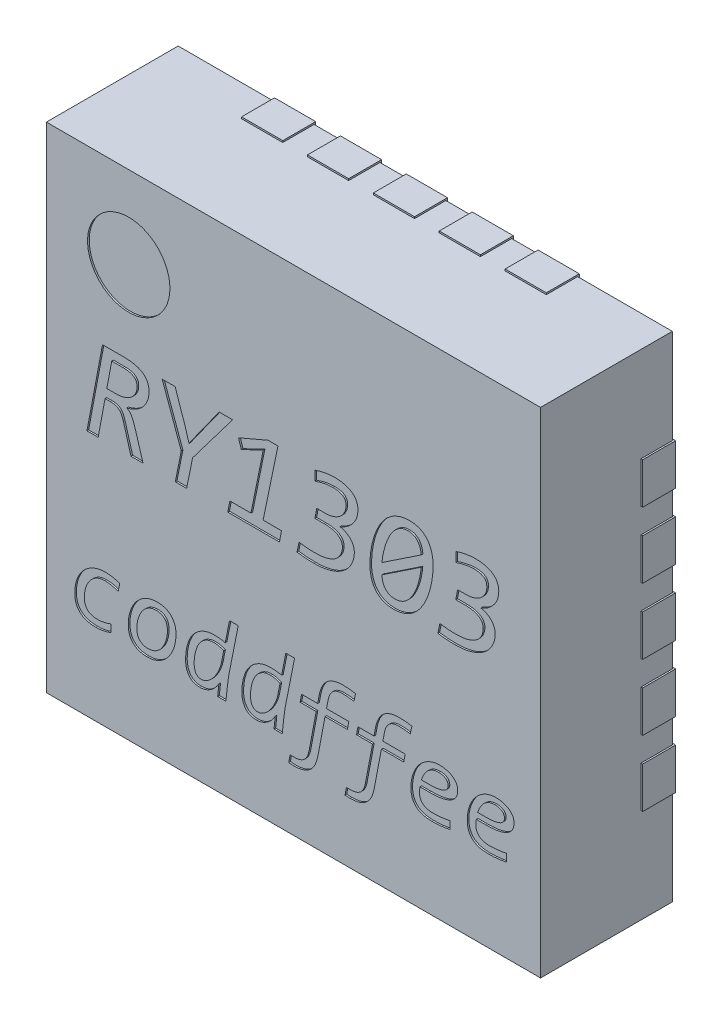
from build123d import *

# Parameters (mm, degrees)
SKETCH_1_W          = 3
SKETCH_1_H          = 3
EXTRUDE_1_DEPTH     = 0.8
SKETCH_3_W          = 0.25
SKETCH_3_H          = 0.31
SKETCH_3_W_2        = 0.31
SKETCH_3_H_2        = 0.25
EXTRUDE_2_DEPTH     = 0.2
EXTRUDE_3_DEPTH     = 0.01
SKETCH_5_R          = 0.25
CUT_EXTRUDE_1_DEPTH = 0.01


with BuildPart() as part:
    # 草图1 → 凸台-拉伸1 (new body)
    with BuildSketch(Plane.XY.offset(0.01)):
        Rectangle(SKETCH_1_W, SKETCH_1_H)
    extrude(amount=EXTRUDE_1_DEPTH)

    # 草图3 → 凸台-拉伸2 (add)
    with BuildSketch(Plane.XY):
        with Locations((0.4, 1.355)):
            Rectangle(SKETCH_3_W, SKETCH_3_H)
        with Locations((0.8, 1.355)):
            Rectangle(SKETCH_3_W, SKETCH_3_H)
        with Locations((0, 1.355)):
            Rectangle(SKETCH_3_W, SKETCH_3_H)
        with Locations((-0.4, 1.355)):
            Rectangle(SKETCH_3_W, SKETCH_3_H)
        with Locations((-0.8, 1.355)):
            Rectangle(SKETCH_3_W, SKETCH_3_H)
        with Locations((1.355, -0.4)):
            Rectangle(SKETCH_3_W_2, SKETCH_3_H_2)
        with Locations((1.355, -0.8)):
            Rectangle(SKETCH_3_W_2, SKETCH_3_H_2)
        with Locations((1.355, 0)):
            Rectangle(SKETCH_3_W_2, SKETCH_3_H_2)
        with Locations((1.355, 0.4)):
            Rectangle(SKETCH_3_W_2, SKETCH_3_H_2)
        with Locations((1.355, 0.8)):
            Rectangle(SKETCH_3_W_2, SKETCH_3_H_2)
        with Locations((-0.4, -1.355)):
            Rectangle(SKETCH_3_W, SKETCH_3_H)
        with Locations((-0.8, -1.355)):
            Rectangle(SKETCH_3_W, SKETCH_3_H)
        with Locations((0, -1.355)):
            Rectangle(SKETCH_3_W, SKETCH_3_H)
        with Locations((0.4, -1.355)):
            Rectangle(SKETCH_3_W, SKETCH_3_H)
        with Locations((0.8, -1.355)):
            Rectangle(SKETCH_3_W, SKETCH_3_H)
        with Locations((-1.355, 0.4)):
            Rectangle(SKETCH_3_W_2, SKETCH_3_H_2)
        with Locations((-1.355, 0.8)):
            Rectangle(SKETCH_3_W_2, SKETCH_3_H_2)
        with Locations((-1.355, 0)):
            Rectangle(SKETCH_3_W_2, SKETCH_3_H_2)
        with Locations((-1.355, -0.4)):
            Rectangle(SKETCH_3_W_2, SKETCH_3_H_2)
        with Locations((-1.355, -0.8)):
            Rectangle(SKETCH_3_W_2, SKETCH_3_H_2)
    extrude(amount=EXTRUDE_2_DEPTH)

    # 草图4 → 凸台-拉伸3 (add)
    with BuildSketch(Plane.XY):
        Polygon((-0.6, 0.9), (-0.9, 0.6), (-0.9, -0.9), (0.9, -0.9), (0.9, 0.9), align=None)
    extrude(amount=EXTRUDE_3_DEPTH)

    # 草图5 → 切除-拉伸1 (cut)
    # profile 1 of 15: a face of its own
    with BuildSketch(Plane.XY.offset(0.81)):
        with Locations((-1, 1)):
            Circle(SKETCH_5_R)
    # profile 2 of 15: a face of its own
    with BuildSketch(Plane.XY.offset(0.81)):
        with BuildLine():
            Line((-0.913043478, 0), (-0.986413043, 0))
            Line((-0.986413043, 0), (-1.032835145, 0.161345109))
            add(Edge.make_bspline(
                [(-1.032835145, 0.161345109), (-1.034602308, 0.167067267), (-1.037871003, 0.177651452), (-1.044714352, 0.191597361), (-1.052128537, 0.203010034), (-1.061114419, 0.211648389), (-1.07139598, 0.217965928), (-1.083111626, 0.221999896), (-1.096306382, 0.224216778), (-1.1055918, 0.224491991), (-1.110507246, 0.224637681)],
                knots=[0, 0, 0, 0, 1.301871799, 2.408051719, 3.372126706, 4.249673638, 5.098074908, 5.979154158, 6.930219327, 8, 8, 8, 8], degree=3))
            Line((-1.110507246, 0.224637681), (-1.14379529, 0.224637681))
            Line((-1.14379529, 0.224637681), (-1.185688406, 0))
            Line((-1.185688406, 0), (-1.253623188, 0))
            Line((-1.253623188, 0), (-1.15942029, 0.5))
            Line((-1.15942029, 0.5), (-1.026154891, 0.5))
            add(Edge.make_bspline(
                [(-1.026154891, 0.5), (-1.020000305, 0.499919349), (-1.008090347, 0.499763278), (-0.990849069, 0.498390289), (-0.974842323, 0.496175515), (-0.960088676, 0.493008026), (-0.94653499, 0.489046513), (-0.934183263, 0.484362363), (-0.923071561, 0.478769042), (-0.913189948, 0.472401967), (-0.904364165, 0.465399214), (-0.896823039, 0.457517325), (-0.890505778, 0.448844561), (-0.885573189, 0.439325379), (-0.881530994, 0.42926362), (-0.878891292, 0.418470354), (-0.877104831, 0.407102182), (-0.876910899, 0.399275137), (-0.876811594, 0.39526721)],
                knots=[0, 0, 0, 0, 1.428775414, 2.764873786, 4.012804054, 5.178099071, 6.265046401, 7.288651419, 8.240944403, 9.147592955, 10.013875543, 10.850579097, 11.672654486, 12.495849996, 13.333883216, 14.184015669, 15.070104566, 16, 16, 16, 16], degree=3))
            add(Edge.make_bspline(
                [(-0.876811594, 0.39526721), (-0.876908286, 0.390468155), (-0.877098586, 0.381023106), (-0.878962758, 0.3671453), (-0.882018439, 0.353797352), (-0.886326693, 0.341038727), (-0.891717183, 0.328886826), (-0.897878708, 0.317232818), (-0.905360245, 0.306392449), (-0.913557148, 0.296014284), (-0.922937568, 0.286513033), (-0.933156373, 0.277651774), (-0.944313661, 0.269451147), (-0.956412998, 0.262035331), (-0.969324775, 0.255299836), (-0.983098434, 0.249629248), (-0.997444759, 0.244411828), (-1.007411035, 0.241807243), (-1.01245471, 0.24048913)],
                knots=[0, 0, 0, 0, 1.031720026, 2.030534343, 3.005241897, 3.972995282, 4.921665738, 5.862349523, 6.803453507, 7.75045548, 8.703353512, 9.670119098, 10.657254079, 11.677768324, 12.719751945, 13.785649931, 14.879374547, 16, 16, 16, 16], degree=3))
            add(Edge.make_bspline(
                [(-1.01245471, 0.24048913), (-1.009293593, 0.239099649), (-1.003014183, 0.23633951), (-0.994707499, 0.230015746), (-0.98762077, 0.222043076), (-0.981672938, 0.212483683), (-0.976449704, 0.201601543), (-0.971322772, 0.189608165), (-0.966601567, 0.176313324), (-0.963767129, 0.166980801), (-0.962296196, 0.162137681)],
                knots=[0, 0, 0, 0, 0.856636413, 1.701668119, 2.572643607, 3.497281282, 4.492452266, 5.573683623, 6.740861098, 8, 8, 8, 8], degree=3))
            Line((-0.962296196, 0.162137681), (-0.913043478, 0))
        make_face()
        with BuildLine():
            add(Edge.make_bspline(
                [(-0.949275362, 0.38451087), (-0.949510887, 0.389037396), (-0.94996063, 0.39768098), (-0.954093096, 0.409749268), (-0.960784661, 0.420100507), (-0.970552948, 0.428292618), (-0.98276664, 0.434631106), (-0.997614182, 0.438905867), (-1.014959884, 0.44161309), (-1.027426301, 0.441884247), (-1.034080616, 0.442028986)],
                knots=[0, 0, 0, 0, 0.932575149, 1.780789645, 2.60257395, 3.448312007, 4.383068545, 5.426411457, 6.626271958, 8, 8, 8, 8], degree=3))
            Line((-1.034080616, 0.442028986), (-1.10326087, 0.442028986))
            Line((-1.10326087, 0.442028986), (-1.133038949, 0.282608696))
            Line((-1.133038949, 0.282608696), (-1.080955616, 0.282608696))
            add(Edge.make_bspline(
                [(-1.080955616, 0.282608696), (-1.07581771, 0.282669913), (-1.065779853, 0.282789514), (-1.051219439, 0.284463354), (-1.037530195, 0.286876314), (-1.024811672, 0.290415604), (-1.013019379, 0.294796294), (-1.002268076, 0.300044384), (-0.992391046, 0.305817054), (-0.983540745, 0.312383137), (-0.975707907, 0.319692249), (-0.968746292, 0.327498382), (-0.962819383, 0.335931901), (-0.957939475, 0.344906752), (-0.954103278, 0.354332812), (-0.951211074, 0.364062092), (-0.949622283, 0.374193007), (-0.949392284, 0.381033474), (-0.949275362, 0.38451087)],
                knots=[0, 0, 0, 0, 1.323424934, 2.585557574, 3.772234431, 4.902602644, 5.982984854, 7.009663973, 7.982204008, 8.927662755, 9.843073413, 10.738895521, 11.618625301, 12.493502107, 13.365942302, 14.237080185, 15.103808318, 16, 16, 16, 16], degree=3))
        make_face(mode=Mode.SUBTRACT)
    # profile 3 of 15: a face of its own
    with BuildSketch(Plane.XY.offset(0.81)):
        Polygon((-0.369565217, 0.5), (-0.612318841, 0.178668478), (-0.648550725, 0), (-0.717391304, 0), (-0.68115942, 0.180140399), (-0.797101449, 0.5), (-0.717957428, 0.5), (-0.656023551, 0.31714221), (-0.634057971, 0.24365942), (-0.587069746, 0.310235507), (-0.450973732, 0.5), align=None)
    # profile 4 of 15: a face of its own
    with BuildSketch(Plane.XY.offset(0.81)):
        Polygon((-0.085031703, 0), (-0.398550725, 0), (-0.386322464, 0.065217391), (-0.258038949, 0.065217391), (-0.183197464, 0.434782609), (-0.316462862, 0.369565217), (-0.333333333, 0.423460145), (-0.154211957, 0.5), (-0.094202899, 0.5), (-0.18432971, 0.065217391), (-0.072463768, 0.065217391), align=None)
    # profile 5 of 15: a face of its own
    with BuildSketch(Plane.XY.offset(0.81)):
        with BuildLine():
            add(Edge.make_bspline(
                [(0.124433877, -0.007246377), (0.114769943, -0.007174452), (0.096033898, -0.007035007), (0.069065418, -0.005549489), (0.044478092, -0.003236222), (0.029016522, -0.001035722), (0.02173913, 0)],
                knots=[0, 0, 0, 0, 1.125244373, 2.181578477, 3.144112525, 4, 4, 4, 4], degree=3))
            Line((0.02173913, 0), (0.033627717, 0.057971014))
            add(Edge.make_bspline(
                [(0.033627717, 0.057971014), (0.041281828, 0.056889443), (0.056857589, 0.054688495), (0.080886421, 0.052504785), (0.106183473, 0.050918556), (0.12352533, 0.050790637), (0.132472826, 0.050724638)],
                knots=[0, 0, 0, 0, 0.934946204, 1.902572078, 2.917836311, 4, 4, 4, 4], degree=3))
            add(Edge.make_bspline(
                [(0.132472826, 0.050724638), (0.137871694, 0.050784165), (0.148302263, 0.050899173), (0.163455158, 0.051941804), (0.177598148, 0.053592103), (0.190783847, 0.055988649), (0.20302509, 0.058925804), (0.214350232, 0.062334078), (0.224844126, 0.066053125), (0.234503044, 0.070231896), (0.243332357, 0.074893052), (0.251398987, 0.079825163), (0.258594115, 0.085220059), (0.26704479, 0.092620254), (0.275964252, 0.102448173), (0.284299964, 0.11496855), (0.290614601, 0.1275698), (0.294291249, 0.140388763), (0.296704414, 0.152685289), (0.296973134, 0.160768738), (0.297101449, 0.164628623)],
                knots=[0, 0, 0, 0, 1.299772521, 2.511149951, 3.655214155, 4.726477618, 5.735947448, 6.684691384, 7.572880921, 8.415310173, 9.216077775, 9.975127322, 10.689392892, 11.378413035, 12.677994941, 13.870132028, 14.9918547, 16.055498095, 17.071491223, 18, 18, 18, 18], degree=3))
            add(Edge.make_bspline(
                [(0.297101449, 0.164628623), (0.29702641, 0.167389957), (0.296880311, 0.172766153), (0.295404195, 0.180524022), (0.292837163, 0.18765729), (0.289458192, 0.194282172), (0.285054494, 0.200300211), (0.279965191, 0.205937108), (0.273876874, 0.210848034), (0.267185334, 0.215445309), (0.259652201, 0.219404428), (0.251321558, 0.222756526), (0.24227149, 0.225761556), (0.228826955, 0.22870126), (0.21051081, 0.231393329), (0.195400323, 0.231715575), (0.1875, 0.231884058)],
                knots=[0, 0, 0, 0, 0.804369065, 1.566071281, 2.289882201, 3.008321537, 3.725833582, 4.457793348, 5.215671894, 5.999924738, 6.821859818, 7.690201543, 8.615699399, 9.597862057, 11.698398745, 14, 14, 14, 14], degree=3))
            Line((0.1875, 0.231884058), (0.130434783, 0.231884058))
            Line((0.130434783, 0.231884058), (0.141530797, 0.289855072))
            Line((0.141530797, 0.289855072), (0.193727355, 0.289855072))
            add(Edge.make_bspline(
                [(0.193727355, 0.289855072), (0.197770019, 0.28993813), (0.205802819, 0.290103166), (0.217713719, 0.291549765), (0.229421663, 0.29365296), (0.240856224, 0.296723921), (0.251860334, 0.300613199), (0.262252696, 0.305441187), (0.272003467, 0.310930769), (0.280995164, 0.317347347), (0.289300752, 0.324435398), (0.296659364, 0.332411528), (0.303193233, 0.341073278), (0.308716348, 0.350497688), (0.313374856, 0.360604601), (0.31644622, 0.371536758), (0.3184563, 0.383078487), (0.318710567, 0.390993575), (0.31884058, 0.395040761)],
                knots=[0, 0, 0, 0, 1.062351751, 2.110900083, 3.150065349, 4.187334327, 5.219799677, 6.214188602, 7.196225628, 8.156981984, 9.113682657, 10.061441281, 11.003992401, 11.960281412, 12.928386697, 13.920545771, 14.936722049, 16, 16, 16, 16], degree=3))
            add(Edge.make_bspline(
                [(0.31884058, 0.395040761), (0.318627779, 0.399409049), (0.318222753, 0.40772327), (0.314442504, 0.419350297), (0.307840459, 0.428958891), (0.298747867, 0.436647737), (0.287191625, 0.442378435), (0.273298889, 0.446493374), (0.256953018, 0.448922703), (0.24525342, 0.449152744), (0.23901721, 0.449275362)],
                knots=[0, 0, 0, 0, 0.954437311, 1.816593178, 2.636964189, 3.474829087, 4.394892396, 5.440256334, 6.635585688, 8, 8, 8, 8], degree=3))
            add(Edge.make_bspline(
                [(0.23901721, 0.449275362), (0.230585106, 0.449008636), (0.213474936, 0.448467402), (0.192076971, 0.444873692), (0.174499142, 0.440782729), (0.16045671, 0.437026183), (0.145647679, 0.432634536), (0.135595446, 0.429265727), (0.130434783, 0.427536232)],
                knots=[0, 0, 0, 0, 1.363894135, 2.7675727, 3.500904345, 4.284566335, 5.119322431, 6, 6, 6, 6], degree=3))
            Line((0.130434783, 0.427536232), (0.130434783, 0.485507246))
            add(Edge.make_bspline(
                [(0.130434783, 0.485507246), (0.135250407, 0.487178145), (0.144999078, 0.490560685), (0.160058334, 0.494792407), (0.175494305, 0.498554143), (0.191155459, 0.50152831), (0.206703228, 0.504060744), (0.221891425, 0.505827517), (0.236468192, 0.507062899), (0.245959301, 0.507186421), (0.250566123, 0.507246377)],
                knots=[0, 0, 0, 0, 0.997467634, 2.019256774, 3.060225063, 4.106213624, 5.138496278, 6.142724634, 7.09851015, 8, 8, 8, 8], degree=3))
            add(Edge.make_bspline(
                [(0.250566123, 0.507246377), (0.256230196, 0.507164392), (0.267235845, 0.50700509), (0.283196858, 0.505636955), (0.298107861, 0.503403139), (0.311921683, 0.500249366), (0.32463199, 0.496284403), (0.336286218, 0.491652201), (0.346817753, 0.486267375), (0.356193895, 0.480070275), (0.364569396, 0.473299337), (0.371686404, 0.465661637), (0.377797682, 0.457454082), (0.382653385, 0.448539715), (0.386516273, 0.439082764), (0.389407535, 0.429078398), (0.390956778, 0.418451288), (0.391186863, 0.41119873), (0.391304348, 0.407495471)],
                knots=[0, 0, 0, 0, 1.397755133, 2.715926088, 3.950337981, 5.116321085, 6.209362646, 7.233383505, 8.208265432, 9.122850261, 10.003061454, 10.859742812, 11.692542171, 12.522209909, 13.357713845, 14.209876032, 15.085937128, 16, 16, 16, 16], degree=3))
            add(Edge.make_bspline(
                [(0.391304348, 0.407495471), (0.391075889, 0.40170498), (0.39059874, 0.389611226), (0.387503086, 0.374449576), (0.384099038, 0.361815904), (0.380245773, 0.352167904), (0.37565008, 0.34245371), (0.3700613, 0.332790112), (0.363475545, 0.323185468), (0.355593189, 0.313858894), (0.346768497, 0.304530801), (0.336749986, 0.295428727), (0.325466004, 0.286677843), (0.312567366, 0.27866103), (0.298386161, 0.270889008), (0.28812331, 0.266518372), (0.282835145, 0.264266304)],
                knots=[0, 0, 0, 0, 1.270586693, 2.65368929, 3.385607181, 4.141207678, 4.930719054, 5.743755761, 6.589659772, 7.484097659, 8.421935785, 9.407473726, 10.453352817, 11.552253419, 12.738743618, 14, 14, 14, 14], degree=3))
            add(Edge.make_bspline(
                [(0.282835145, 0.264266304), (0.288702658, 0.262933381), (0.300322995, 0.260293587), (0.316582218, 0.253298375), (0.331615651, 0.244768503), (0.342337355, 0.235474714), (0.34998766, 0.227347482), (0.354983037, 0.220613996), (0.359309585, 0.213330104), (0.362908646, 0.205499806), (0.365878323, 0.197215796), (0.368060201, 0.188424496), (0.369278912, 0.179155691), (0.369468892, 0.172821918), (0.369565217, 0.169610507)],
                knots=[0, 0, 0, 0, 1.542696212, 3.0552383, 4.528550673, 5.966177289, 6.679723653, 7.393335888, 8.115004393, 8.852457741, 9.603802697, 10.372770565, 11.174946438, 12, 12, 12, 12], degree=3))
            add(Edge.make_bspline(
                [(0.369565217, 0.169610507), (0.369249907, 0.16324946), (0.368597668, 0.150091221), (0.364116534, 0.130184966), (0.356771173, 0.110002564), (0.348013691, 0.093573897), (0.339410398, 0.080822016), (0.331964691, 0.071317208), (0.323578327, 0.062075409), (0.314330812, 0.053014171), (0.304131917, 0.044398614), (0.292945624, 0.036336183), (0.280823694, 0.028737172), (0.267695181, 0.021743052), (0.253563408, 0.0153534), (0.238377902, 0.009737089), (0.222124347, 0.00474186), (0.204813447, 0.000481729), (0.186399363, -0.003150567), (0.166779949, -0.00533129), (0.146015584, -0.007085291), (0.131760005, -0.007191695), (0.124433877, -0.007246377)],
                knots=[0, 0, 0, 0, 1.134649483, 2.347095982, 3.623116724, 4.957586207, 5.656079458, 6.365969811, 7.10973525, 7.881152222, 8.674362301, 9.489255638, 10.339361458, 11.225046133, 12.141230231, 13.104319261, 14.111795072, 15.173357376, 16.284015618, 17.457503136, 18.693377587, 20, 20, 20, 20], degree=3))
        make_face()
    # profile 6 of 15: a face of its own
    with BuildSketch(Plane.XY.offset(0.81)):
        with BuildLine():
            add(Edge.make_bspline(
                [(0.60620471, -0.007246377), (0.600954163, -0.007100602), (0.590685662, -0.006815511), (0.575621763, -0.005030378), (0.561304451, -0.001820549), (0.547681812, 0.002533139), (0.534926149, 0.008306403), (0.523192475, 0.015528222), (0.512336816, 0.023960201), (0.502435251, 0.033718556), (0.493641013, 0.044960187), (0.486022268, 0.057559327), (0.479258239, 0.071407389), (0.473604421, 0.086599729), (0.46923505, 0.103178352), (0.466084159, 0.121090176), (0.46415282, 0.140356399), (0.463899047, 0.153678928), (0.463768116, 0.160552536)],
                knots=[0, 0, 0, 0, 1.007320364, 1.970017588, 2.90453218, 3.818085205, 4.709096538, 5.583269886, 6.455131516, 7.340832138, 8.243184708, 9.185658703, 10.160315356, 11.195836441, 12.289964397, 13.444606486, 14.681573724, 16, 16, 16, 16], degree=3))
            add(Edge.make_bspline(
                [(0.463768116, 0.160552536), (0.463935729, 0.167537206), (0.464293153, 0.182431596), (0.46612872, 0.205945289), (0.469437752, 0.231558287), (0.474131133, 0.258752612), (0.480624205, 0.287022084), (0.488742636, 0.31598611), (0.499050374, 0.344815519), (0.511485981, 0.372952293), (0.526318635, 0.399746733), (0.540528397, 0.420925051), (0.553162682, 0.436743679), (0.563257093, 0.447943578), (0.574167639, 0.458220587), (0.585715521, 0.467806072), (0.598090619, 0.476392615), (0.611147375, 0.484107249), (0.624862459, 0.490939321), (0.639331794, 0.496697372), (0.654556539, 0.501620327), (0.670758477, 0.504725878), (0.687780828, 0.506901657), (0.699418855, 0.507129491), (0.705389493, 0.507246377)],
                knots=[0, 0, 0, 0, 0.983508977, 2.097273836, 3.318505522, 4.618352553, 5.980809812, 7.400391859, 8.850813716, 10.287505912, 11.726367946, 13.157359761, 13.871838869, 14.575246903, 15.278092789, 15.980195145, 16.686247279, 17.396127794, 18.113761176, 18.840950007, 19.587109667, 20.362403165, 21.159866475, 22, 22, 22, 22], degree=3))
            add(Edge.make_bspline(
                [(0.705389493, 0.507246377), (0.710639421, 0.50709752), (0.720906711, 0.506806401), (0.735987586, 0.505063563), (0.750246248, 0.501701637), (0.763802652, 0.497312608), (0.77660482, 0.491690388), (0.788370094, 0.484487563), (0.799301785, 0.476082762), (0.808999215, 0.466092242), (0.81794177, 0.454993882), (0.825596293, 0.44241513), (0.832330365, 0.428591196), (0.838002136, 0.413402453), (0.842313829, 0.396807312), (0.845702325, 0.37893159), (0.847388258, 0.359633777), (0.847677048, 0.346318969), (0.847826087, 0.339447464)],
                knots=[0, 0, 0, 0, 1.007519252, 1.970406553, 2.906703269, 3.813552425, 4.701763106, 5.582294801, 6.454328573, 7.34020407, 8.247226692, 9.183719418, 10.15856851, 11.194294051, 12.288638035, 13.444801513, 14.681313411, 16, 16, 16, 16], degree=3))
            add(Edge.make_bspline(
                [(0.847826087, 0.339447464), (0.847714418, 0.332461789), (0.847475019, 0.317485769), (0.845416159, 0.293872826), (0.842185941, 0.268136366), (0.837444488, 0.240911961), (0.831028573, 0.212648305), (0.822688136, 0.183863575), (0.812539259, 0.155043293), (0.800004572, 0.127040523), (0.785236632, 0.100183139), (0.771081703, 0.078990024), (0.758464011, 0.063151603), (0.748296522, 0.052016223), (0.737323285, 0.041808568), (0.725780816, 0.032226376), (0.713487187, 0.023579017), (0.700425051, 0.015856161), (0.686585402, 0.009102418), (0.672085207, 0.003120548), (0.656737538, -0.001538604), (0.640579704, -0.004756373), (0.623659996, -0.006885139), (0.612099055, -0.007124393), (0.60620471, -0.007246377)],
                knots=[0, 0, 0, 0, 0.983358193, 2.108141662, 3.334653408, 4.634509843, 5.996976958, 7.412925025, 8.851561986, 10.295282677, 11.726935779, 13.162340783, 13.87682506, 14.57631381, 15.283030534, 15.98513797, 16.686843167, 17.396728818, 18.119131638, 18.853242527, 19.602918259, 20.373010585, 21.170479664, 22, 22, 22, 22], degree=3))
        make_face()
        with BuildLine():
            add(Edge.make_bspline(
                [(0.616168478, 0.050724638), (0.620290335, 0.050852364), (0.628397409, 0.051103584), (0.640318951, 0.053181687), (0.651655153, 0.056735837), (0.662522175, 0.061522534), (0.672754747, 0.067582232), (0.68258963, 0.074479755), (0.69170836, 0.082501979), (0.700502021, 0.091195173), (0.708619795, 0.100893696), (0.716328376, 0.111331762), (0.723604044, 0.1225344), (0.732448117, 0.138675922), (0.742591591, 0.159854974), (0.752806209, 0.18646211), (0.761393214, 0.21393164), (0.767590014, 0.242012424), (0.772592827, 0.269726553), (0.774455835, 0.288141352), (0.775362319, 0.297101449)],
                knots=[0, 0, 0, 0, 0.697985219, 1.372832266, 2.04223556, 2.706365949, 3.379696825, 4.053846856, 4.738347739, 5.434602983, 6.146850836, 6.878325688, 7.632068676, 8.407730472, 9.994965438, 11.606242171, 13.232268665, 14.865519972, 16.474854573, 18, 18, 18, 18], degree=3))
            Line((0.775362319, 0.297101449), (0.536231884, 0.137681159))
            add(Edge.make_bspline(
                [(0.536231884, 0.137681159), (0.537021625, 0.131548795), (0.538542355, 0.119740269), (0.542620865, 0.102905817), (0.548803742, 0.087917313), (0.555849368, 0.076962166), (0.562760986, 0.069657507), (0.568428561, 0.064708746), (0.57479484, 0.060574728), (0.581675133, 0.056990075), (0.589224901, 0.054138086), (0.597543111, 0.052092231), (0.606630288, 0.051029099), (0.612920284, 0.050828321), (0.616168478, 0.050724638)],
                knots=[0, 0, 0, 0, 1.67889269, 3.232887858, 4.689415349, 6.065581733, 6.740090105, 7.416154797, 8.104237989, 8.796584627, 9.520106762, 10.290891389, 11.117405419, 12, 12, 12, 12], degree=3))
        make_face(mode=Mode.SUBTRACT)
        with BuildLine():
            add(Edge.make_bspline(
                [(0.696218297, 0.449275362), (0.692095098, 0.44915307), (0.684022596, 0.448913644), (0.672202822, 0.446780891), (0.660930449, 0.44341541), (0.650265343, 0.438580339), (0.640146459, 0.432676938), (0.630615738, 0.425653549), (0.621425448, 0.417892885), (0.612833949, 0.409136003), (0.604754073, 0.399519499), (0.597091086, 0.389172848), (0.589919534, 0.37794782), (0.580884725, 0.361969749), (0.570967942, 0.340634074), (0.560663509, 0.314005129), (0.552242524, 0.286304789), (0.545402114, 0.258216988), (0.540324094, 0.230334526), (0.538106248, 0.211893477), (0.537024457, 0.202898551)],
                knots=[0, 0, 0, 0, 0.699105571, 1.36872642, 2.031204443, 2.690548697, 3.350670022, 4.015496388, 4.69692579, 5.389785013, 6.094150606, 6.826799565, 7.57289987, 8.352941364, 9.939974205, 11.559810885, 13.194567727, 14.848789836, 16.462945086, 18, 18, 18, 18], degree=3))
            Line((0.537024457, 0.202898551), (0.776154891, 0.362318841))
            add(Edge.make_bspline(
                [(0.776154891, 0.362318841), (0.775290177, 0.368426857), (0.773614185, 0.380265434), (0.768652888, 0.396946528), (0.76227571, 0.411966862), (0.754939584, 0.422793389), (0.748050704, 0.43008203), (0.742495959, 0.435071188), (0.736182726, 0.439204903), (0.729414934, 0.442905657), (0.721962465, 0.445671661), (0.714001327, 0.447944294), (0.70530169, 0.448960676), (0.699314513, 0.449168096), (0.696218297, 0.449275362)],
                knots=[0, 0, 0, 0, 1.688192296, 3.272059616, 4.753604763, 6.144763221, 6.8251676, 7.499335038, 8.184828526, 8.888033964, 9.608219138, 10.358298917, 11.151008669, 12, 12, 12, 12], degree=3))
        make_face(mode=Mode.SUBTRACT)
    # profile 7 of 15: a face of its own
    with BuildSketch(Plane.XY.offset(0.81)):
        with BuildLine():
            add(Edge.make_bspline(
                [(0.979506341, -0.007246377), (0.969842407, -0.007174452), (0.951106361, -0.007035007), (0.924137882, -0.005549489), (0.899550556, -0.003236222), (0.884088985, -0.001035722), (0.876811594, 0)],
                knots=[0, 0, 0, 0, 1.125244373, 2.181578477, 3.144112525, 4, 4, 4, 4], degree=3))
            Line((0.876811594, 0), (0.888700181, 0.057971014))
            add(Edge.make_bspline(
                [(0.888700181, 0.057971014), (0.896354292, 0.056889443), (0.911930052, 0.054688495), (0.935958885, 0.052504785), (0.961255936, 0.050918556), (0.978597794, 0.050790637), (0.98754529, 0.050724638)],
                knots=[0, 0, 0, 0, 0.934946204, 1.902572078, 2.917836311, 4, 4, 4, 4], degree=3))
            add(Edge.make_bspline(
                [(0.98754529, 0.050724638), (0.992944158, 0.050784165), (1.003374727, 0.050899173), (1.018527622, 0.051941804), (1.032670611, 0.053592103), (1.045856311, 0.055988649), (1.058097554, 0.058925804), (1.069422696, 0.062334078), (1.07991659, 0.066053125), (1.089575508, 0.070231896), (1.09840482, 0.074893052), (1.106471451, 0.079825163), (1.113666579, 0.085220059), (1.122117254, 0.092620254), (1.131036716, 0.102448173), (1.139372427, 0.11496855), (1.145687064, 0.1275698), (1.149363713, 0.140388763), (1.151776878, 0.152685289), (1.152045598, 0.160768738), (1.152173913, 0.164628623)],
                knots=[0, 0, 0, 0, 1.299772521, 2.511149951, 3.655214155, 4.726477618, 5.735947448, 6.684691384, 7.572880921, 8.415310173, 9.216077775, 9.975127322, 10.689392892, 11.378413035, 12.677994941, 13.870132028, 14.9918547, 16.055498095, 17.071491223, 18, 18, 18, 18], degree=3))
            add(Edge.make_bspline(
                [(1.152173913, 0.164628623), (1.152098873, 0.167389957), (1.151952774, 0.172766153), (1.150476659, 0.180524022), (1.147909627, 0.18765729), (1.144530655, 0.194282172), (1.140126957, 0.200300211), (1.135037655, 0.205937108), (1.128949338, 0.210848034), (1.122257798, 0.215445309), (1.114724665, 0.219404428), (1.106394022, 0.222756526), (1.097343954, 0.225761556), (1.083899419, 0.22870126), (1.065583273, 0.231393329), (1.050472787, 0.231715575), (1.042572464, 0.231884058)],
                knots=[0, 0, 0, 0, 0.804369065, 1.566071281, 2.289882201, 3.008321537, 3.725833582, 4.457793348, 5.215671894, 5.999924738, 6.821859818, 7.690201543, 8.615699399, 9.597862057, 11.698398745, 14, 14, 14, 14], degree=3))
            Line((1.042572464, 0.231884058), (0.985507246, 0.231884058))
            Line((0.985507246, 0.231884058), (0.996603261, 0.289855072))
            Line((0.996603261, 0.289855072), (1.048799819, 0.289855072))
            add(Edge.make_bspline(
                [(1.048799819, 0.289855072), (1.052842483, 0.28993813), (1.060875283, 0.290103166), (1.072786183, 0.291549765), (1.084494127, 0.29365296), (1.095928688, 0.296723921), (1.106932798, 0.300613199), (1.11732516, 0.305441187), (1.127075931, 0.310930769), (1.136067628, 0.317347347), (1.144373216, 0.324435398), (1.151731827, 0.332411528), (1.158265697, 0.341073278), (1.163788811, 0.350497688), (1.168447319, 0.360604601), (1.171518684, 0.371536758), (1.173528764, 0.383078487), (1.17378303, 0.390993575), (1.173913043, 0.395040761)],
                knots=[0, 0, 0, 0, 1.062351751, 2.110900083, 3.150065349, 4.187334327, 5.219799677, 6.214188602, 7.196225628, 8.156981984, 9.113682657, 10.061441281, 11.003992401, 11.960281412, 12.928386697, 13.920545771, 14.936722049, 16, 16, 16, 16], degree=3))
            add(Edge.make_bspline(
                [(1.173913043, 0.395040761), (1.173700243, 0.399409049), (1.173295217, 0.40772327), (1.169514967, 0.419350297), (1.162912923, 0.428958891), (1.153820331, 0.436647737), (1.142264089, 0.442378435), (1.128371353, 0.446493374), (1.112025482, 0.448922703), (1.100325884, 0.449152744), (1.094089674, 0.449275362)],
                knots=[0, 0, 0, 0, 0.954437311, 1.816593178, 2.636964189, 3.474829087, 4.394892396, 5.440256334, 6.635585688, 8, 8, 8, 8], degree=3))
            add(Edge.make_bspline(
                [(1.094089674, 0.449275362), (1.08565757, 0.449008636), (1.0685474, 0.448467402), (1.047149435, 0.444873692), (1.029571605, 0.440782729), (1.015529173, 0.437026183), (1.000720143, 0.432634536), (0.99066791, 0.429265727), (0.985507246, 0.427536232)],
                knots=[0, 0, 0, 0, 1.363894135, 2.7675727, 3.500904345, 4.284566335, 5.119322431, 6, 6, 6, 6], degree=3))
            Line((0.985507246, 0.427536232), (0.985507246, 0.485507246))
            add(Edge.make_bspline(
                [(0.985507246, 0.485507246), (0.990322871, 0.487178145), (1.000071541, 0.490560685), (1.015130797, 0.494792407), (1.030566769, 0.498554143), (1.046227922, 0.50152831), (1.061775692, 0.504060744), (1.076963888, 0.505827517), (1.091540656, 0.507062899), (1.101031764, 0.507186421), (1.105638587, 0.507246377)],
                knots=[0, 0, 0, 0, 0.997467634, 2.019256774, 3.060225063, 4.106213624, 5.138496278, 6.142724634, 7.09851015, 8, 8, 8, 8], degree=3))
            add(Edge.make_bspline(
                [(1.105638587, 0.507246377), (1.111302659, 0.507164392), (1.122308308, 0.50700509), (1.138269322, 0.505636955), (1.153180325, 0.503403139), (1.166994146, 0.500249366), (1.179704454, 0.496284403), (1.191358682, 0.491652201), (1.201890217, 0.486267375), (1.211266359, 0.480070275), (1.21964186, 0.473299337), (1.226758868, 0.465661637), (1.232870146, 0.457454082), (1.237725849, 0.448539715), (1.241588737, 0.439082764), (1.244479999, 0.429078398), (1.246029242, 0.418451288), (1.246259327, 0.41119873), (1.246376812, 0.407495471)],
                knots=[0, 0, 0, 0, 1.397755133, 2.715926088, 3.950337981, 5.116321085, 6.209362646, 7.233383505, 8.208265432, 9.122850261, 10.003061454, 10.859742812, 11.692542171, 12.522209909, 13.357713845, 14.209876032, 15.085937128, 16, 16, 16, 16], degree=3))
            add(Edge.make_bspline(
                [(1.246376812, 0.407495471), (1.246148353, 0.40170498), (1.245671204, 0.389611226), (1.242575549, 0.374449576), (1.239171502, 0.361815904), (1.235318237, 0.352167904), (1.230722543, 0.34245371), (1.225133764, 0.332790112), (1.218548009, 0.323185468), (1.210665653, 0.313858894), (1.20184096, 0.304530801), (1.19182245, 0.295428727), (1.180538468, 0.286677843), (1.16763983, 0.27866103), (1.153458625, 0.270889008), (1.143195773, 0.266518372), (1.137907609, 0.264266304)],
                knots=[0, 0, 0, 0, 1.270586693, 2.65368929, 3.385607181, 4.141207678, 4.930719054, 5.743755761, 6.589659772, 7.484097659, 8.421935785, 9.407473726, 10.453352817, 11.552253419, 12.738743618, 14, 14, 14, 14], degree=3))
            add(Edge.make_bspline(
                [(1.137907609, 0.264266304), (1.143775122, 0.262933381), (1.155395459, 0.260293587), (1.171654681, 0.253298375), (1.186688115, 0.244768503), (1.197409818, 0.235474714), (1.205060124, 0.227347482), (1.210055501, 0.220613996), (1.214382049, 0.213330104), (1.21798111, 0.205499806), (1.220950787, 0.197215796), (1.223132664, 0.188424496), (1.224351375, 0.179155691), (1.224541356, 0.172821918), (1.224637681, 0.169610507)],
                knots=[0, 0, 0, 0, 1.542696212, 3.0552383, 4.528550673, 5.966177289, 6.679723653, 7.393335888, 8.115004393, 8.852457741, 9.603802697, 10.372770565, 11.174946438, 12, 12, 12, 12], degree=3))
            add(Edge.make_bspline(
                [(1.224637681, 0.169610507), (1.224322371, 0.16324946), (1.223670132, 0.150091221), (1.219188998, 0.130184966), (1.211843637, 0.110002564), (1.203086155, 0.093573897), (1.194482862, 0.080822016), (1.187037155, 0.071317208), (1.178650791, 0.062075409), (1.169403276, 0.053014171), (1.15920438, 0.044398614), (1.148018087, 0.036336183), (1.135896158, 0.028737172), (1.122767645, 0.021743052), (1.108635871, 0.0153534), (1.093450365, 0.009737089), (1.077196811, 0.00474186), (1.059885911, 0.000481729), (1.041471827, -0.003150567), (1.021852413, -0.00533129), (1.001088048, -0.007085291), (0.986832469, -0.007191695), (0.979506341, -0.007246377)],
                knots=[0, 0, 0, 0, 1.134649483, 2.347095982, 3.623116724, 4.957586207, 5.656079458, 6.365969811, 7.10973525, 7.881152222, 8.674362301, 9.489255638, 10.339361458, 11.225046133, 12.141230231, 13.104319261, 14.111795072, 15.173357376, 16.284015618, 17.457503136, 18.693377587, 20, 20, 20, 20], degree=3))
        make_face()
    # profile 8 of 15: a face of its own
    with BuildSketch(Plane.XY.offset(0.81)):
        with BuildLine():
            add(Edge.make_bspline(
                [(-1.107246377, -0.988405797), (-1.111431119, -0.989862898), (-1.119631487, -0.992718214), (-1.131840918, -0.996257124), (-1.143551994, -0.999452001), (-1.158628657, -1.002518223), (-1.177408722, -1.005267415), (-1.192500733, -1.005619857), (-1.20009058, -1.005797101)],
                knots=[0, 0, 0, 0, 0.839908974, 1.645875128, 2.409506226, 3.140337848, 4.561861934, 6, 6, 6, 6], degree=3))
            add(Edge.make_bspline(
                [(-1.20009058, -1.005797101), (-1.205046035, -1.005717488), (-1.214704695, -1.005562314), (-1.228709965, -1.004151879), (-1.241880467, -1.00206462), (-1.25412705, -0.998836163), (-1.265591863, -0.994910756), (-1.276162073, -0.990001967), (-1.285834733, -0.984189052), (-1.294585952, -0.977440417), (-1.30243503, -0.96983439), (-1.309167661, -0.961255459), (-1.314837041, -0.951771129), (-1.319543704, -0.941452269), (-1.323183774, -0.930207292), (-1.325662516, -0.918083704), (-1.327231359, -0.905083208), (-1.327432551, -0.896109791), (-1.327536232, -0.891485507)],
                knots=[0, 0, 0, 0, 1.215690106, 2.36949708, 3.451153649, 4.484479016, 5.473336333, 6.421379596, 7.338817531, 8.236903162, 9.127623286, 10.014018602, 10.904769542, 11.833152403, 12.791476214, 13.798514549, 14.865505469, 16, 16, 16, 16], degree=3))
            add(Edge.make_bspline(
                [(-1.327536232, -0.891485507), (-1.327383222, -0.883836349), (-1.327083974, -0.8688765), (-1.324129285, -0.847038423), (-1.319733176, -0.826278248), (-1.313209041, -0.806795174), (-1.305278444, -0.78851669), (-1.295803602, -0.771683784), (-1.285225628, -0.756088342), (-1.273058005, -0.742157935), (-1.25988926, -0.729494361), (-1.245429422, -0.718504542), (-1.230028507, -0.708922189), (-1.213550853, -0.701104721), (-1.196380553, -0.694655253), (-1.178457, -0.690324516), (-1.160056314, -0.687452499), (-1.147595533, -0.68712292), (-1.141304348, -0.686956522)],
                knots=[0, 0, 0, 0, 1.185736364, 2.319005028, 3.412113172, 4.4724488, 5.500001804, 6.497963684, 7.464409164, 8.417326071, 9.36136403, 10.293337708, 11.229068886, 12.169534127, 13.117779137, 14.068449478, 15.024800869, 16, 16, 16, 16], degree=3))
            add(Edge.make_bspline(
                [(-1.141304348, -0.686956522), (-1.133927023, -0.687143794), (-1.119108654, -0.687519956), (-1.100706372, -0.690186585), (-1.086151931, -0.69326796), (-1.07544924, -0.696227911), (-1.065099442, -0.699976486), (-1.058409178, -0.70289316), (-1.055072464, -0.704347826)],
                knots=[0, 0, 0, 0, 1.497558936, 3.008052721, 3.766875002, 4.518129283, 5.260929232, 6, 6, 6, 6], degree=3))
            Line((-1.055072464, -0.704347826), (-1.064492754, -0.750724638))
            add(Edge.make_bspline(
                [(-1.064492754, -0.750724638), (-1.067344042, -0.749415327), (-1.073148017, -0.746750143), (-1.082377456, -0.74344704), (-1.09213052, -0.740438758), (-1.105740063, -0.737158885), (-1.122784345, -0.734053058), (-1.136518966, -0.733569018), (-1.143206522, -0.733333333)],
                knots=[0, 0, 0, 0, 0.695235539, 1.415195007, 2.17106577, 2.956782457, 4.518220033, 6, 6, 6, 6], degree=3))
            add(Edge.make_bspline(
                [(-1.143206522, -0.733333333), (-1.148167049, -0.733491505), (-1.157844454, -0.733800078), (-1.171958456, -0.73616595), (-1.185154965, -0.740274072), (-1.197448703, -0.745897092), (-1.208667285, -0.752977772), (-1.219130804, -0.760954041), (-1.228529674, -0.770177183), (-1.237085308, -0.780320925), (-1.244530469, -0.791419153), (-1.251239953, -0.803149207), (-1.256832618, -0.815693845), (-1.261418593, -0.828887438), (-1.26501001, -0.842522656), (-1.267656672, -0.856379017), (-1.269234262, -0.87043448), (-1.269454387, -0.879857192), (-1.269565217, -0.884601449)],
                knots=[0, 0, 0, 0, 1.082496608, 2.111823749, 3.112434542, 4.091521005, 5.05351085, 6.002659194, 6.958124849, 7.921806453, 8.894304761, 9.871192698, 10.868281046, 11.887536561, 12.917053581, 13.943380192, 14.964509106, 16, 16, 16, 16], degree=3))
            add(Edge.make_bspline(
                [(-1.269565217, -0.884601449), (-1.269533842, -0.887624428), (-1.269472787, -0.89350711), (-1.26840508, -0.902007889), (-1.266933472, -0.909937188), (-1.264714985, -0.917270914), (-1.261955518, -0.924071583), (-1.258480952, -0.930250705), (-1.254465049, -0.935893788), (-1.249737161, -0.940850786), (-1.244415943, -0.945261051), (-1.238474716, -0.94906229), (-1.231974716, -0.952361712), (-1.224807372, -0.954813751), (-1.217178351, -0.956977721), (-1.208914784, -0.958341524), (-1.200083397, -0.959307692), (-1.193994512, -0.959381955), (-1.190851449, -0.95942029)],
                knots=[0, 0, 0, 0, 1.165091352, 2.267254589, 3.299589576, 4.272264836, 5.217359905, 6.124527273, 7.000433721, 7.881896635, 8.758654267, 9.65989703, 10.597355715, 11.562472296, 12.576716248, 13.652728644, 14.788346095, 16, 16, 16, 16], degree=3))
            add(Edge.make_bspline(
                [(-1.190851449, -0.95942029), (-1.184013901, -0.959207543), (-1.169929356, -0.958769309), (-1.148727935, -0.955198845), (-1.127469615, -0.950110098), (-1.113926334, -0.944698266), (-1.107246377, -0.942028986)],
                knots=[0, 0, 0, 0, 0.954314192, 1.965774807, 2.996658311, 4, 4, 4, 4], degree=3))
            Line((-1.107246377, -0.942028986), (-1.107246377, -0.988405797))
        make_face()
    # profile 9 of 15: a face of its own
    with BuildSketch(Plane.XY.offset(0.81)):
        with BuildLine():
            add(Edge.make_bspline(
                [(-0.888134058, -1.005797101), (-0.89251613, -1.005716156), (-0.901090798, -1.005557765), (-0.913560474, -1.004150118), (-0.92530433, -1.00204347), (-0.936276557, -0.998924493), (-0.946526395, -0.994979682), (-0.956032868, -0.990052121), (-0.964747349, -0.984211135), (-0.972788908, -0.977621145), (-0.979901711, -0.970032515), (-0.986085995, -0.961536997), (-0.991381772, -0.952200509), (-0.995516988, -0.941871754), (-0.998892545, -0.930759699), (-1.001175207, -0.918733536), (-1.002692613, -0.905866225), (-1.002828339, -0.896985424), (-1.002898551, -0.892391304)],
                knots=[0, 0, 0, 0, 1.141646598, 2.233929725, 3.266416212, 4.247835534, 5.202032763, 6.124121111, 7.03199869, 7.931689465, 8.827932607, 9.734479312, 10.664623906, 11.617360007, 12.628057728, 13.6866895, 14.803303379, 16, 16, 16, 16], degree=3))
            add(Edge.make_bspline(
                [(-1.002898551, -0.892391304), (-1.002628804, -0.883921741), (-1.002089391, -0.866985146), (-0.998666192, -0.846031019), (-0.994914327, -0.829540871), (-0.991189309, -0.817461093), (-0.987098532, -0.805601806), (-0.982247059, -0.794066786), (-0.976865936, -0.78284488), (-0.9707352, -0.772064315), (-0.964165435, -0.761606693), (-0.956876604, -0.751668369), (-0.94914188, -0.742114002), (-0.940712466, -0.733286504), (-0.931790611, -0.725040957), (-0.922245105, -0.717558083), (-0.912251252, -0.710607961), (-0.901573828, -0.704682776), (-0.890502398, -0.699369161), (-0.878904205, -0.694931741), (-0.866787283, -0.691402128), (-0.854178399, -0.688702996), (-0.841003309, -0.687317255), (-0.832067921, -0.687077909), (-0.827536232, -0.686956522)],
                knots=[0, 0, 0, 0, 1.858857387, 3.717159102, 4.649815244, 5.570520451, 6.49093922, 7.403228976, 8.31643355, 9.221759899, 10.12475318, 11.026431456, 11.926182468, 12.821821206, 13.703887938, 14.591170666, 15.482973885, 16.373494926, 17.269010986, 18.177608077, 19.096425929, 20.037735659, 21.004814226, 22, 22, 22, 22], degree=3))
            add(Edge.make_bspline(
                [(-0.827536232, -0.686956522), (-0.823154555, -0.687039925), (-0.814580659, -0.687203125), (-0.802099875, -0.68857714), (-0.790333142, -0.690812615), (-0.779346201, -0.694017399), (-0.769027351, -0.697934435), (-0.759608492, -0.702952678), (-0.750981465, -0.708779038), (-0.743260398, -0.715534151), (-0.73630786, -0.723108556), (-0.730200057, -0.731575863), (-0.725040459, -0.741001157), (-0.720698639, -0.751254835), (-0.717220796, -0.762380317), (-0.714853359, -0.774407747), (-0.71323257, -0.7872748), (-0.713107651, -0.7961601), (-0.713043478, -0.800724638)],
                knots=[0, 0, 0, 0, 1.143056594, 2.236688751, 3.271920425, 4.264294496, 5.219670211, 6.14655428, 7.042485212, 7.930378231, 8.817012025, 9.72005062, 10.647503729, 11.614759953, 12.621478753, 13.682968704, 14.809699572, 16, 16, 16, 16], degree=3))
            add(Edge.make_bspline(
                [(-0.713043478, -0.800724638), (-0.71326869, -0.809105115), (-0.713720844, -0.825930481), (-0.717273827, -0.846721016), (-0.721056433, -0.863174181), (-0.724718577, -0.875243088), (-0.728866186, -0.887126089), (-0.733774751, -0.898649382), (-0.739183613, -0.909881655), (-0.745184245, -0.920720138), (-0.751818599, -0.931146809), (-0.758996031, -0.941170275), (-0.766846963, -0.950600637), (-0.775122997, -0.959545802), (-0.784184191, -0.967631662), (-0.793530721, -0.975324306), (-0.803574249, -0.982100293), (-0.814098118, -0.988236574), (-0.82524678, -0.993439538), (-0.836879376, -0.997929647), (-0.849027355, -1.001454485), (-0.8616555, -1.004013541), (-0.874755627, -1.005445488), (-0.883631966, -1.005678777), (-0.888134058, -1.005797101)],
                knots=[0, 0, 0, 0, 1.84208112, 3.698320055, 4.626249392, 5.555034008, 6.470905589, 7.393590999, 8.308498809, 9.212273784, 10.116951255, 11.025690995, 11.921991869, 12.814742241, 13.703357251, 14.591252183, 15.475488037, 16.365194469, 17.268383561, 18.178675294, 19.105582014, 20.047313385, 21.009594378, 22, 22, 22, 22], degree=3))
        make_face()
        with BuildLine():
            add(Edge.make_bspline(
                [(-0.765217391, -0.806431159), (-0.765266656, -0.803470253), (-0.765362369, -0.797717758), (-0.766181269, -0.789391078), (-0.767523876, -0.781632259), (-0.76943249, -0.774450436), (-0.771819072, -0.767787104), (-0.774972749, -0.761800388), (-0.778465051, -0.756302384), (-0.78260365, -0.751451789), (-0.787251729, -0.747201731), (-0.792338567, -0.743410025), (-0.798037662, -0.740390172), (-0.804115532, -0.737693373), (-0.810782843, -0.73570896), (-0.817959297, -0.734434426), (-0.825577031, -0.733444599), (-0.830823778, -0.733371051), (-0.833514493, -0.733333333)],
                knots=[0, 0, 0, 0, 1.240615765, 2.410287131, 3.502446362, 4.53678098, 5.521636354, 6.461062037, 7.366555277, 8.246309069, 9.123876229, 10.002081719, 10.896813424, 11.820599536, 12.785334428, 13.802813944, 14.873206279, 16, 16, 16, 16], degree=3))
            add(Edge.make_bspline(
                [(-0.833514493, -0.733333333), (-0.836630376, -0.733379947), (-0.842738728, -0.733471329), (-0.851721701, -0.734878984), (-0.86041325, -0.736743822), (-0.868667169, -0.739751445), (-0.876584756, -0.74326561), (-0.884123736, -0.747459785), (-0.891302511, -0.752243138), (-0.900213148, -0.759552823), (-0.910553026, -0.769874119), (-0.921264859, -0.78399366), (-0.930258208, -0.799518421), (-0.937692093, -0.815946738), (-0.943529146, -0.833150165), (-0.947568407, -0.850823326), (-0.950249709, -0.868487775), (-0.950568457, -0.880214327), (-0.950724638, -0.885960145)],
                knots=[0, 0, 0, 0, 0.701318591, 1.374859408, 2.044954982, 2.701265056, 3.349948515, 3.995591952, 4.642846591, 5.291030321, 6.590001898, 7.924949826, 9.272735746, 10.62470543, 11.982347069, 13.358748851, 14.705830486, 16, 16, 16, 16], degree=3))
            add(Edge.make_bspline(
                [(-0.950724638, -0.885960145), (-0.950675905, -0.88892111), (-0.950581226, -0.894673718), (-0.949752132, -0.903029228), (-0.9484266, -0.910819735), (-0.94652098, -0.918037683), (-0.94407502, -0.924685091), (-0.941109155, -0.930783303), (-0.937529078, -0.936271825), (-0.933459832, -0.94120336), (-0.928773449, -0.945498006), (-0.92358446, -0.949199749), (-0.917959511, -0.952416799), (-0.911780717, -0.954910047), (-0.905182794, -0.957085848), (-0.897978463, -0.958306908), (-0.890366154, -0.959312354), (-0.885118643, -0.959383701), (-0.882427536, -0.95942029)],
                knots=[0, 0, 0, 0, 1.237296598, 2.403838601, 3.505505571, 4.537072909, 5.519293382, 6.461798251, 7.364868917, 8.251926422, 9.127145721, 10.013215261, 10.911689218, 11.828064219, 12.793935007, 13.808692338, 14.876220925, 16, 16, 16, 16], degree=3))
            add(Edge.make_bspline(
                [(-0.882427536, -0.95942029), (-0.879284778, -0.959317976), (-0.873098224, -0.959116571), (-0.864007051, -0.957983799), (-0.855358472, -0.955831367), (-0.847090846, -0.953064093), (-0.839255216, -0.949446137), (-0.831732563, -0.945333004), (-0.824661201, -0.940470505), (-0.815653909, -0.933322138), (-0.805419719, -0.922892697), (-0.794787489, -0.908710738), (-0.785642485, -0.893244693), (-0.77823577, -0.876686392), (-0.772458942, -0.859409274), (-0.768346527, -0.841694422), (-0.765696401, -0.823992708), (-0.765374928, -0.812206797), (-0.765217391, -0.806431159)],
                knots=[0, 0, 0, 0, 0.707243642, 1.392216721, 2.056153913, 2.709160199, 3.350582067, 3.995161195, 4.635719292, 5.2785782, 6.580220427, 7.908859017, 9.257864901, 10.613796069, 11.982074077, 13.349593163, 14.701178851, 16, 16, 16, 16], degree=3))
        make_face(mode=Mode.SUBTRACT)
    # profile 10 of 15: a face of its own
    with BuildSketch(Plane.XY.offset(0.81)):
        with BuildLine():
            add(Edge.make_bspline(
                [(-0.479619565, -0.686956522), (-0.476116634, -0.686962839), (-0.469380415, -0.686974989), (-0.459717739, -0.687372701), (-0.450890935, -0.687863654), (-0.440388414, -0.688963051), (-0.428120787, -0.690818708), (-0.418731383, -0.693333119), (-0.414130435, -0.694565217)],
                knots=[0, 0, 0, 0, 0.952879262, 1.832409507, 2.630706935, 3.35732455, 4.705049526, 6, 6, 6, 6], degree=3))
            Line((-0.414130435, -0.694565217), (-0.388405797, -0.565217391))
            Line((-0.388405797, -0.565217391), (-0.335235507, -0.565217391))
            Line((-0.335235507, -0.565217391), (-0.393478261, -0.857971014))
            add(Edge.make_bspline(
                [(-0.393478261, -0.857971014), (-0.393878083, -0.860234291), (-0.394788278, -0.865386633), (-0.395849398, -0.872275595), (-0.396804727, -0.878886412), (-0.397468186, -0.884910474), (-0.398440646, -0.891748358), (-0.399301309, -0.899487319), (-0.400316232, -0.908120298), (-0.401408419, -0.917751455), (-0.402558565, -0.928446331), (-0.403946533, -0.940245077), (-0.405436684, -0.953251066), (-0.40679079, -0.967612472), (-0.408612981, -0.983323), (-0.409680126, -0.994291558), (-0.410235507, -1)],
                knots=[0, 0, 0, 0, 0.674832782, 1.536254714, 2.046545403, 2.635956164, 3.315547478, 4.074318507, 4.92217534, 5.867929057, 6.920396456, 8.080568018, 9.356256233, 10.76418106, 12.315960681, 14, 14, 14, 14], degree=3))
            Line((-0.410235507, -1), (-0.460235507, -1))
            Line((-0.460235507, -1), (-0.452626812, -0.928804348))
            add(Edge.make_bspline(
                [(-0.452626812, -0.928804348), (-0.456174618, -0.934723765), (-0.46308337, -0.946250827), (-0.475475658, -0.961612817), (-0.488804392, -0.975015387), (-0.503322876, -0.98608478), (-0.518695692, -0.994873769), (-0.534787624, -1.001205802), (-0.551570104, -1.005061333), (-0.562993369, -1.00555056), (-0.56875, -1.005797101)],
                knots=[0, 0, 0, 0, 1.131397534, 2.203205121, 3.229835287, 4.226847727, 5.189950431, 6.12668795, 7.055964661, 8, 8, 8, 8], degree=3))
            add(Edge.make_bspline(
                [(-0.56875, -1.005797101), (-0.572316881, -1.00571479), (-0.579206664, -1.005555798), (-0.589208691, -1.0042004), (-0.598451777, -1.001820047), (-0.607055546, -0.998682806), (-0.614890771, -0.994569557), (-0.622029351, -0.989628468), (-0.628467736, -0.983903992), (-0.634253175, -0.977423074), (-0.639186754, -0.970116468), (-0.64356892, -0.962224106), (-0.647212355, -0.953633507), (-0.650068211, -0.944361991), (-0.652313627, -0.934488101), (-0.653955452, -0.92408056), (-0.654825855, -0.913148856), (-0.654989015, -0.905707899), (-0.655072464, -0.901902174)],
                knots=[0, 0, 0, 0, 1.114413261, 2.152599024, 3.145817099, 4.092261941, 5.008109593, 5.903259949, 6.798907473, 7.694554997, 8.610597055, 9.548157557, 10.512079284, 11.520774242, 12.57597221, 13.674290854, 14.810501189, 16, 16, 16, 16], degree=3))
            add(Edge.make_bspline(
                [(-0.655072464, -0.901902174), (-0.654939484, -0.894619623), (-0.65467678, -0.880232867), (-0.652401395, -0.858993819), (-0.648943935, -0.838391876), (-0.643931835, -0.818569917), (-0.637705692, -0.799634356), (-0.629831111, -0.781918225), (-0.620803307, -0.76534164), (-0.610358346, -0.750056249), (-0.598545582, -0.736125748), (-0.585394815, -0.723656638), (-0.570861915, -0.7128328), (-0.555131725, -0.703504928), (-0.538070277, -0.696019723), (-0.519663226, -0.690804363), (-0.500054609, -0.68755523), (-0.486546886, -0.687159479), (-0.479619565, -0.686956522)],
                knots=[0, 0, 0, 0, 1.122066352, 2.216653982, 3.288432494, 4.339154487, 5.364795967, 6.356519679, 7.322841687, 8.270211146, 9.2044617, 10.132724934, 11.056873547, 11.991402185, 12.945819445, 13.919296721, 14.932929065, 16, 16, 16, 16], degree=3))
        make_face()
        with BuildLine():
            add(Edge.make_bspline(
                [(-0.602898551, -0.895923913), (-0.602789702, -0.900610687), (-0.602582928, -0.909513942), (-0.600708121, -0.922087819), (-0.59758136, -0.933090339), (-0.593231709, -0.942520924), (-0.58725884, -0.950171399), (-0.579514257, -0.955608221), (-0.570174011, -0.958886017), (-0.563434046, -0.959235599), (-0.559873188, -0.95942029)],
                knots=[0, 0, 0, 0, 1.29322691, 2.456685177, 3.498548183, 4.441719091, 5.307346128, 6.144495858, 7.019700473, 8, 8, 8, 8], degree=3))
            add(Edge.make_bspline(
                [(-0.559873188, -0.95942029), (-0.557663348, -0.95935815), (-0.553212263, -0.959232986), (-0.546570947, -0.957961518), (-0.539904781, -0.956085361), (-0.53097632, -0.952334341), (-0.519916156, -0.946010571), (-0.507095294, -0.936342595), (-0.494890968, -0.924447323), (-0.483341505, -0.910750059), (-0.472644438, -0.895590116), (-0.462925087, -0.879258763), (-0.454024557, -0.862141872), (-0.44695049, -0.844244237), (-0.440814753, -0.826592413), (-0.438150958, -0.814702901), (-0.436865942, -0.808967391)],
                knots=[0, 0, 0, 0, 0.449362803, 0.905111708, 1.371998053, 1.857099344, 2.87260121, 3.956832971, 5.11746798, 6.334167092, 7.599571547, 8.889795871, 10.201004841, 11.521587451, 12.804411819, 14, 14, 14, 14], degree=3))
            Line((-0.436865942, -0.808967391), (-0.423369565, -0.74067029))
            add(Edge.make_bspline(
                [(-0.423369565, -0.74067029), (-0.428230447, -0.73876764), (-0.437965305, -0.734957215), (-0.45287109, -0.730951001), (-0.467349932, -0.728146784), (-0.476830454, -0.727733054), (-0.48134058, -0.727536232)],
                knots=[0, 0, 0, 0, 1.047178837, 2.097178493, 3.09477923, 4, 4, 4, 4], degree=3))
            add(Edge.make_bspline(
                [(-0.48134058, -0.727536232), (-0.485421995, -0.727635669), (-0.49334761, -0.727828764), (-0.504869802, -0.729465963), (-0.515556244, -0.732266998), (-0.52545108, -0.736100073), (-0.534506017, -0.740886101), (-0.543004956, -0.746216212), (-0.550805059, -0.752318346), (-0.557958376, -0.759044246), (-0.564526998, -0.766277455), (-0.570289615, -0.774148936), (-0.575615357, -0.782391555), (-0.581664088, -0.794092296), (-0.58797038, -0.809263186), (-0.594095752, -0.827720032), (-0.598261992, -0.846224192), (-0.601048472, -0.864057667), (-0.602462389, -0.880593057), (-0.602760199, -0.891060923), (-0.602898551, -0.895923913)],
                knots=[0, 0, 0, 0, 0.948237405, 1.84136254, 2.697471858, 3.510602768, 4.30150909, 5.074341284, 5.839328887, 6.59889052, 7.354128947, 8.106362348, 8.863586663, 9.632586607, 11.163945054, 12.677320379, 14.146299986, 15.566469154, 16.8694701, 18, 18, 18, 18], degree=3))
        make_face(mode=Mode.SUBTRACT)
    # profile 11 of 15: a face of its own
    with BuildSketch(Plane.XY.offset(0.81)):
        with BuildLine():
            add(Edge.make_bspline(
                [(-0.13759058, -0.686956522), (-0.134087649, -0.686962839), (-0.12735143, -0.686974989), (-0.117688754, -0.687372701), (-0.10886195, -0.687863654), (-0.098359428, -0.688963051), (-0.086091801, -0.690818708), (-0.076702397, -0.693333119), (-0.072101449, -0.694565217)],
                knots=[0, 0, 0, 0, 0.952879262, 1.832409507, 2.630706935, 3.35732455, 4.705049526, 6, 6, 6, 6], degree=3))
            Line((-0.072101449, -0.694565217), (-0.046376812, -0.565217391))
            Line((-0.046376812, -0.565217391), (0.006793478, -0.565217391))
            Line((0.006793478, -0.565217391), (-0.051449275, -0.857971014))
            add(Edge.make_bspline(
                [(-0.051449275, -0.857971014), (-0.051849098, -0.860234291), (-0.052759292, -0.865386633), (-0.053820413, -0.872275595), (-0.054775741, -0.878886412), (-0.055439201, -0.884910474), (-0.056411661, -0.891748358), (-0.057272324, -0.899487319), (-0.058287246, -0.908120298), (-0.059379433, -0.917751455), (-0.06052958, -0.928446331), (-0.061917547, -0.940245077), (-0.063407698, -0.953251066), (-0.064761804, -0.967612472), (-0.066583995, -0.983323), (-0.06765114, -0.994291558), (-0.068206522, -1)],
                knots=[0, 0, 0, 0, 0.674832782, 1.536254714, 2.046545403, 2.635956164, 3.315547478, 4.074318507, 4.92217534, 5.867929057, 6.920396456, 8.080568018, 9.356256233, 10.76418106, 12.315960681, 14, 14, 14, 14], degree=3))
            Line((-0.068206522, -1), (-0.118206522, -1))
            Line((-0.118206522, -1), (-0.110597826, -0.928804348))
            add(Edge.make_bspline(
                [(-0.110597826, -0.928804348), (-0.114145632, -0.934723765), (-0.121054384, -0.946250827), (-0.133446673, -0.961612817), (-0.146775407, -0.975015387), (-0.16129389, -0.98608478), (-0.176666707, -0.994873769), (-0.192758638, -1.001205802), (-0.209541118, -1.005061333), (-0.220964384, -1.00555056), (-0.226721014, -1.005797101)],
                knots=[0, 0, 0, 0, 1.131397534, 2.203205121, 3.229835287, 4.226847727, 5.189950431, 6.12668795, 7.055964661, 8, 8, 8, 8], degree=3))
            add(Edge.make_bspline(
                [(-0.226721014, -1.005797101), (-0.230287896, -1.00571479), (-0.237177679, -1.005555798), (-0.247179706, -1.0042004), (-0.256422791, -1.001820047), (-0.26502656, -0.998682806), (-0.272861786, -0.994569557), (-0.280000366, -0.989628468), (-0.28643875, -0.983903992), (-0.29222419, -0.977423074), (-0.297157768, -0.970116468), (-0.301539934, -0.962224106), (-0.305183369, -0.953633507), (-0.308039226, -0.944361991), (-0.310284641, -0.934488101), (-0.311926467, -0.92408056), (-0.312796869, -0.913148856), (-0.312960029, -0.905707899), (-0.313043478, -0.901902174)],
                knots=[0, 0, 0, 0, 1.114413261, 2.152599024, 3.145817099, 4.092261941, 5.008109593, 5.903259949, 6.798907473, 7.694554997, 8.610597055, 9.548157557, 10.512079284, 11.520774242, 12.57597221, 13.674290854, 14.810501189, 16, 16, 16, 16], degree=3))
            add(Edge.make_bspline(
                [(-0.313043478, -0.901902174), (-0.312910498, -0.894619623), (-0.312647794, -0.880232867), (-0.31037241, -0.858993819), (-0.306914949, -0.838391876), (-0.30190285, -0.818569917), (-0.295676706, -0.799634356), (-0.287802126, -0.781918225), (-0.278774322, -0.76534164), (-0.26832936, -0.750056249), (-0.256516596, -0.736125748), (-0.24336583, -0.723656638), (-0.228832929, -0.7128328), (-0.21310274, -0.703504928), (-0.196041291, -0.696019723), (-0.17763424, -0.690804363), (-0.158025624, -0.68755523), (-0.1445179, -0.687159479), (-0.13759058, -0.686956522)],
                knots=[0, 0, 0, 0, 1.122066352, 2.216653982, 3.288432494, 4.339154487, 5.364795967, 6.356519679, 7.322841687, 8.270211146, 9.2044617, 10.132724934, 11.056873547, 11.991402185, 12.945819445, 13.919296721, 14.932929065, 16, 16, 16, 16], degree=3))
        make_face()
        with BuildLine():
            add(Edge.make_bspline(
                [(-0.260869565, -0.895923913), (-0.260760717, -0.900610687), (-0.260553942, -0.909513942), (-0.258679135, -0.922087819), (-0.255552374, -0.933090339), (-0.251202723, -0.942520924), (-0.245229854, -0.950171399), (-0.237485272, -0.955608221), (-0.228145026, -0.958886017), (-0.22140506, -0.959235599), (-0.217844203, -0.95942029)],
                knots=[0, 0, 0, 0, 1.29322691, 2.456685177, 3.498548183, 4.441719091, 5.307346128, 6.144495858, 7.019700473, 8, 8, 8, 8], degree=3))
            add(Edge.make_bspline(
                [(-0.217844203, -0.95942029), (-0.215634363, -0.95935815), (-0.211183278, -0.959232986), (-0.204541962, -0.957961518), (-0.197875796, -0.956085361), (-0.188947335, -0.952334341), (-0.177887171, -0.946010571), (-0.165066309, -0.936342595), (-0.152861983, -0.924447323), (-0.14131252, -0.910750059), (-0.130615453, -0.895590116), (-0.120896101, -0.879258763), (-0.111995571, -0.862141872), (-0.104921505, -0.844244237), (-0.098785767, -0.826592413), (-0.096121973, -0.814702901), (-0.094836957, -0.808967391)],
                knots=[0, 0, 0, 0, 0.449362803, 0.905111708, 1.371998053, 1.857099344, 2.87260121, 3.956832971, 5.11746798, 6.334167092, 7.599571547, 8.889795871, 10.201004841, 11.521587451, 12.804411819, 14, 14, 14, 14], degree=3))
            Line((-0.094836957, -0.808967391), (-0.08134058, -0.74067029))
            add(Edge.make_bspline(
                [(-0.08134058, -0.74067029), (-0.086201462, -0.73876764), (-0.095936319, -0.734957215), (-0.110842104, -0.730951001), (-0.125320947, -0.728146784), (-0.134801468, -0.727733054), (-0.139311594, -0.727536232)],
                knots=[0, 0, 0, 0, 1.047178837, 2.097178493, 3.09477923, 4, 4, 4, 4], degree=3))
            add(Edge.make_bspline(
                [(-0.139311594, -0.727536232), (-0.143393009, -0.727635669), (-0.151318625, -0.727828764), (-0.162840816, -0.729465963), (-0.173527258, -0.732266998), (-0.183422094, -0.736100073), (-0.192477032, -0.740886101), (-0.200975971, -0.746216212), (-0.208776073, -0.752318346), (-0.215929391, -0.759044246), (-0.222498012, -0.766277455), (-0.22826063, -0.774148936), (-0.233586371, -0.782391555), (-0.239635102, -0.794092296), (-0.245941394, -0.809263186), (-0.252066766, -0.827720032), (-0.256233006, -0.846224192), (-0.259019486, -0.864057667), (-0.260433403, -0.880593057), (-0.260731213, -0.891060923), (-0.260869565, -0.895923913)],
                knots=[0, 0, 0, 0, 0.948237405, 1.84136254, 2.697471858, 3.510602768, 4.30150909, 5.074341284, 5.839328887, 6.59889052, 7.354128947, 8.106362348, 8.863586663, 9.632586607, 11.163945054, 12.677320379, 14.146299986, 15.566469154, 16.8694701, 18, 18, 18, 18], degree=3))
        make_face(mode=Mode.SUBTRACT)
    # profile 12 of 15: a face of its own
    with BuildSketch(Plane.XY.offset(0.81)):
        with BuildLine():
            add(Edge.make_bspline(
                [(0.148731884, -1.00634058), (0.147617022, -1.01178963), (0.145459459, -1.022335039), (0.14130257, -1.037420018), (0.136430745, -1.051193765), (0.130915018, -1.063736825), (0.124568262, -1.075058482), (0.117663218, -1.085488898), (0.109696148, -1.094728645), (0.101059158, -1.103057969), (0.091562443, -1.110368545), (0.081184284, -1.116617716), (0.069981206, -1.12188782), (0.057935812, -1.126154035), (0.044987245, -1.129426908), (0.031064968, -1.131591997), (0.016187458, -1.13312875), (0.005922157, -1.133263776), (0.000634058, -1.133333333)],
                knots=[0, 0, 0, 0, 1.230541562, 2.381435688, 3.459179677, 4.461154228, 5.409265584, 6.328401861, 7.224121817, 8.10306401, 8.979717751, 9.870039045, 10.778624224, 11.714795467, 12.693556841, 13.729354659, 14.830292694, 16, 16, 16, 16], degree=3))
            add(Edge.make_bspline(
                [(0.000634058, -1.133333333), (-0.001630346, -1.133303486), (-0.006582283, -1.133238213), (-0.01419712, -1.133130243), (-0.021801579, -1.132637091), (-0.026721157, -1.132307499), (-0.028985507, -1.132155797)],
                knots=[0, 0, 0, 0, 0.916566605, 2.004403543, 3.081480481, 4, 4, 4, 4], degree=3))
            Line((-0.028985507, -1.132155797), (-0.020289855, -1.086956522))
            add(Edge.make_bspline(
                [(-0.020289855, -1.086956522), (-0.015700483, -1.086956522), (-0.006853865, -1.086956522), (0.001992754, -1.086956522), (0.00625, -1.086956522)],
                knots=[0, 0, 0, 0, 1.037542662, 2, 2, 2, 2], degree=3))
            add(Edge.make_bspline(
                [(0.00625, -1.086956522), (0.009241759, -1.086915272), (0.015088896, -1.086834653), (0.023593697, -1.085890307), (0.031657254, -1.084459336), (0.039255376, -1.082413443), (0.046379093, -1.079630592), (0.053077544, -1.07641557), (0.059312113, -1.072574342), (0.065047575, -1.068105767), (0.070382828, -1.0629631), (0.075258287, -1.057060682), (0.079705415, -1.050408604), (0.083688048, -1.043032626), (0.087221041, -1.034939269), (0.090275253, -1.026081595), (0.093018324, -1.016505102), (0.094398631, -1.009793301), (0.095108696, -1.00634058)],
                knots=[0, 0, 0, 0, 1.079686829, 2.110155707, 3.085163963, 4.034546179, 4.945539966, 5.842600549, 6.713856492, 7.583884064, 8.462744629, 9.383921057, 10.342334831, 11.347172967, 12.406415223, 13.526879592, 14.727763661, 16, 16, 16, 16], degree=3))
            Line((0.095108696, -1.00634058), (0.138043478, -0.779710145))
            Line((0.138043478, -0.779710145), (0.04057971, -0.779710145))
            Line((0.04057971, -0.779710145), (0.049365942, -0.733333333))
            Line((0.049365942, -0.733333333), (0.14692029, -0.733333333))
            Line((0.14692029, -0.733333333), (0.155706522, -0.687137681))
            add(Edge.make_bspline(
                [(0.155706522, -0.687137681), (0.156788201, -0.681868548), (0.158898512, -0.671588696), (0.163070873, -0.65685064), (0.167930094, -0.64313382), (0.173713746, -0.630580696), (0.179844199, -0.618877729), (0.187014177, -0.608413286), (0.194784172, -0.59893127), (0.203381585, -0.590520931), (0.212777383, -0.583112863), (0.223065359, -0.576766594), (0.234221897, -0.571415229), (0.246205095, -0.566928578), (0.259159873, -0.563642863), (0.272966084, -0.561224917), (0.287643413, -0.559614881), (0.297731107, -0.559486204), (0.302898551, -0.55942029)],
                knots=[0, 0, 0, 0, 1.194450244, 2.330320955, 3.399511415, 4.423007577, 5.398233684, 6.330159548, 7.235225641, 8.117339257, 8.996132324, 9.887603815, 10.796463712, 11.740759542, 12.724892428, 13.760251112, 14.852683714, 16, 16, 16, 16], degree=3))
            add(Edge.make_bspline(
                [(0.302898551, -0.55942029), (0.308547129, -0.559516107), (0.320402337, -0.559717206), (0.338713319, -0.561157392), (0.357744131, -0.563277503), (0.370481133, -0.565541453), (0.376811594, -0.566666667)],
                knots=[0, 0, 0, 0, 0.911446406, 1.912938903, 2.962702695, 4, 4, 4, 4], degree=3))
            Line((0.376811594, -0.566666667), (0.367300725, -0.611594203))
            add(Edge.make_bspline(
                [(0.367300725, -0.611594203), (0.361509571, -0.610731498), (0.349893242, -0.60900102), (0.332391753, -0.607268144), (0.31487425, -0.60597458), (0.303202891, -0.605856221), (0.297373188, -0.605797101)],
                knots=[0, 0, 0, 0, 1.00020693, 2.006289874, 3.004166046, 4, 4, 4, 4], degree=3))
            add(Edge.make_bspline(
                [(0.297373188, -0.605797101), (0.294412141, -0.60584012), (0.288656272, -0.605923741), (0.280228776, -0.606839379), (0.272292635, -0.60843209), (0.264710345, -0.610304618), (0.257703414, -0.613140925), (0.251051713, -0.616313546), (0.244968228, -0.620319939), (0.239175142, -0.624698711), (0.234000324, -0.629983764), (0.229170335, -0.635869705), (0.224811932, -0.642571703), (0.220839237, -0.649993166), (0.217295728, -0.658203776), (0.214247729, -0.667177455), (0.211627627, -0.676898676), (0.210230366, -0.683657394), (0.20951087, -0.687137681)],
                knots=[0, 0, 0, 0, 1.070260168, 2.0804389, 3.058799095, 3.996106414, 4.898172692, 5.786663282, 6.655695763, 7.526919315, 8.406852598, 9.322358342, 10.276048987, 11.291873848, 12.362579262, 13.505209524, 14.715350128, 16, 16, 16, 16], degree=3))
            Line((0.20951087, -0.687137681), (0.200634058, -0.733333333))
            Line((0.200634058, -0.733333333), (0.336231884, -0.733333333))
            Line((0.336231884, -0.733333333), (0.327264493, -0.779710145))
            Line((0.327264493, -0.779710145), (0.191757246, -0.779710145))
            Line((0.191757246, -0.779710145), (0.148731884, -1.00634058))
        make_face()
    # profile 13 of 15: a face of its own
    with BuildSketch(Plane.XY.offset(0.81)):
        with BuildLine():
            add(Edge.make_bspline(
                [(0.49076087, -1.00634058), (0.489646008, -1.01178963), (0.487488445, -1.022335039), (0.483331556, -1.037420018), (0.478459731, -1.051193765), (0.472944004, -1.063736825), (0.466597247, -1.075058482), (0.459692204, -1.085488898), (0.451725133, -1.094728645), (0.443088144, -1.103057969), (0.433591428, -1.110368545), (0.42321327, -1.116617716), (0.412010191, -1.12188782), (0.399964797, -1.126154035), (0.387016231, -1.129426908), (0.373093954, -1.131591997), (0.358216444, -1.13312875), (0.347951143, -1.133263776), (0.342663043, -1.133333333)],
                knots=[0, 0, 0, 0, 1.230541562, 2.381435688, 3.459179677, 4.461154228, 5.409265584, 6.328401861, 7.224121817, 8.10306401, 8.979717751, 9.870039045, 10.778624224, 11.714795467, 12.693556841, 13.729354659, 14.830292694, 16, 16, 16, 16], degree=3))
            add(Edge.make_bspline(
                [(0.342663043, -1.133333333), (0.340398639, -1.133303486), (0.335446702, -1.133238213), (0.327831866, -1.133130243), (0.320227406, -1.132637091), (0.315307828, -1.132307499), (0.313043478, -1.132155797)],
                knots=[0, 0, 0, 0, 0.916566605, 2.004403543, 3.081480481, 4, 4, 4, 4], degree=3))
            Line((0.313043478, -1.132155797), (0.32173913, -1.086956522))
            add(Edge.make_bspline(
                [(0.32173913, -1.086956522), (0.326328502, -1.086956522), (0.335175121, -1.086956522), (0.344021739, -1.086956522), (0.348278986, -1.086956522)],
                knots=[0, 0, 0, 0, 1.037542662, 2, 2, 2, 2], degree=3))
            add(Edge.make_bspline(
                [(0.348278986, -1.086956522), (0.351270744, -1.086915272), (0.357117881, -1.086834653), (0.365622683, -1.085890307), (0.373686239, -1.084459336), (0.381284362, -1.082413443), (0.388408078, -1.079630592), (0.39510653, -1.07641557), (0.401341098, -1.072574342), (0.40707656, -1.068105767), (0.412411814, -1.0629631), (0.417287272, -1.057060682), (0.421734401, -1.050408604), (0.425717034, -1.043032626), (0.429250027, -1.034939269), (0.432304239, -1.026081595), (0.43504731, -1.016505102), (0.436427616, -1.009793301), (0.437137681, -1.00634058)],
                knots=[0, 0, 0, 0, 1.079686829, 2.110155707, 3.085163963, 4.034546179, 4.945539966, 5.842600549, 6.713856492, 7.583884064, 8.462744629, 9.383921057, 10.342334831, 11.347172967, 12.406415223, 13.526879592, 14.727763661, 16, 16, 16, 16], degree=3))
            Line((0.437137681, -1.00634058), (0.480072464, -0.779710145))
            Line((0.480072464, -0.779710145), (0.382608696, -0.779710145))
            Line((0.382608696, -0.779710145), (0.391394928, -0.733333333))
            Line((0.391394928, -0.733333333), (0.488949275, -0.733333333))
            Line((0.488949275, -0.733333333), (0.497735507, -0.687137681))
            add(Edge.make_bspline(
                [(0.497735507, -0.687137681), (0.498817187, -0.681868548), (0.500927497, -0.671588696), (0.505099859, -0.65685064), (0.50995908, -0.64313382), (0.515742731, -0.630580696), (0.521873185, -0.618877729), (0.529043162, -0.608413286), (0.536813157, -0.59893127), (0.54541057, -0.590520931), (0.554806368, -0.583112863), (0.565094345, -0.576766594), (0.576250882, -0.571415229), (0.588234081, -0.566928578), (0.601188859, -0.563642863), (0.614995069, -0.561224917), (0.629672399, -0.559614881), (0.639760093, -0.559486204), (0.644927536, -0.55942029)],
                knots=[0, 0, 0, 0, 1.194450244, 2.330320955, 3.399511415, 4.423007577, 5.398233684, 6.330159548, 7.235225641, 8.117339257, 8.996132324, 9.887603815, 10.796463712, 11.740759542, 12.724892428, 13.760251112, 14.852683714, 16, 16, 16, 16], degree=3))
            add(Edge.make_bspline(
                [(0.644927536, -0.55942029), (0.650576115, -0.559516107), (0.662431322, -0.559717206), (0.680742304, -0.561157392), (0.699773116, -0.563277503), (0.712510119, -0.565541453), (0.71884058, -0.566666667)],
                knots=[0, 0, 0, 0, 0.911446406, 1.912938903, 2.962702695, 4, 4, 4, 4], degree=3))
            Line((0.71884058, -0.566666667), (0.70932971, -0.611594203))
            add(Edge.make_bspline(
                [(0.70932971, -0.611594203), (0.703538556, -0.610731498), (0.691922227, -0.60900102), (0.674420739, -0.607268144), (0.656903236, -0.60597458), (0.645231876, -0.605856221), (0.639402174, -0.605797101)],
                knots=[0, 0, 0, 0, 1.00020693, 2.006289874, 3.004166046, 4, 4, 4, 4], degree=3))
            add(Edge.make_bspline(
                [(0.639402174, -0.605797101), (0.636441127, -0.60584012), (0.630685258, -0.605923741), (0.622257762, -0.606839379), (0.61432162, -0.60843209), (0.606739331, -0.610304618), (0.599732399, -0.613140925), (0.593080699, -0.616313546), (0.586997213, -0.620319939), (0.581204127, -0.624698711), (0.576029309, -0.629983764), (0.571199321, -0.635869705), (0.566840917, -0.642571703), (0.562868223, -0.649993166), (0.559324714, -0.658203776), (0.556276714, -0.667177455), (0.553656613, -0.676898676), (0.552259351, -0.683657394), (0.551539855, -0.687137681)],
                knots=[0, 0, 0, 0, 1.070260168, 2.0804389, 3.058799095, 3.996106414, 4.898172692, 5.786663282, 6.655695763, 7.526919315, 8.406852598, 9.322358342, 10.276048987, 11.291873848, 12.362579262, 13.505209524, 14.715350128, 16, 16, 16, 16], degree=3))
            Line((0.551539855, -0.687137681), (0.542663043, -0.733333333))
            Line((0.542663043, -0.733333333), (0.67826087, -0.733333333))
            Line((0.67826087, -0.733333333), (0.669293478, -0.779710145))
            Line((0.669293478, -0.779710145), (0.533786232, -0.779710145))
            Line((0.533786232, -0.779710145), (0.49076087, -1.00634058))
        make_face()
    # profile 14 of 15: a face of its own
    with BuildSketch(Plane.XY.offset(0.81)):
        with BuildLine():
            add(Edge.make_bspline(
                [(0.768297101, -0.860869565), (0.767825746, -0.863493269), (0.766912664, -0.868575763), (0.76588472, -0.876034177), (0.765327893, -0.883203745), (0.765254034, -0.887891632), (0.765217391, -0.890217391)],
                knots=[0, 0, 0, 0, 1.08232327, 2.096616488, 3.055691347, 4, 4, 4, 4], degree=3))
            add(Edge.make_bspline(
                [(0.765217391, -0.890217391), (0.765247096, -0.892939126), (0.765304747, -0.898221412), (0.766394989, -0.905874339), (0.767849224, -0.913095971), (0.770153804, -0.919783232), (0.772969842, -0.926020074), (0.776393489, -0.931795602), (0.780643307, -0.936934995), (0.785351305, -0.941743178), (0.790844022, -0.945887724), (0.796969129, -0.949554375), (0.803817966, -0.952614488), (0.811360088, -0.955177373), (0.819637586, -0.956985738), (0.828545638, -0.958495248), (0.838150685, -0.95926516), (0.844775488, -0.959367544), (0.848188406, -0.95942029)],
                knots=[0, 0, 0, 0, 1.055944961, 2.049356281, 2.996932652, 3.912853921, 4.789187031, 5.651920497, 6.510820284, 7.373155204, 8.25970624, 9.174726308, 10.14034242, 11.167507463, 12.262637455, 13.42702108, 14.674471489, 16, 16, 16, 16], degree=3))
            add(Edge.make_bspline(
                [(0.848188406, -0.95942029), (0.857282341, -0.95923469), (0.875444306, -0.958864019), (0.897940252, -0.956672369), (0.915450568, -0.954252121), (0.927852951, -0.952232805), (0.939556956, -0.950206089), (0.947075699, -0.948603731), (0.950724638, -0.947826087)],
                knots=[0, 0, 0, 0, 1.583428581, 3.162346657, 3.931925035, 4.661452502, 5.350386456, 6, 6, 6, 6], degree=3))
            Line((0.950724638, -0.947826087), (0.950724638, -0.994202899))
            add(Edge.make_bspline(
                [(0.950724638, -0.994202899), (0.946773543, -0.995039356), (0.93862141, -0.996765184), (0.925995615, -0.999003192), (0.912645342, -1.000997405), (0.893887404, -1.003288272), (0.869757979, -1.005313826), (0.850276318, -1.005635499), (0.84048913, -1.005797101)],
                knots=[0, 0, 0, 0, 0.654614253, 1.350638792, 2.078096303, 2.842372918, 4.413672753, 6, 6, 6, 6], degree=3))
            add(Edge.make_bspline(
                [(0.84048913, -1.005797101), (0.835232304, -1.005716804), (0.825062284, -1.005561457), (0.810322421, -1.00418138), (0.796627539, -1.001963911), (0.78398006, -0.998812533), (0.772404173, -0.99475623), (0.761895434, -0.989745353), (0.752406517, -0.983866648), (0.744019132, -0.977031582), (0.736676815, -0.969313441), (0.730350669, -0.960781502), (0.724916084, -0.951444718), (0.720636097, -0.941246518), (0.717143484, -0.930314809), (0.714740614, -0.918564913), (0.713263102, -0.906016422), (0.713118066, -0.897377493), (0.713043478, -0.892934783)],
                knots=[0, 0, 0, 0, 1.293447622, 2.502344158, 3.639629483, 4.704713845, 5.705880857, 6.653092546, 7.564386988, 8.446370468, 9.308313088, 10.179177427, 11.054752337, 11.960181222, 12.895485203, 13.874795397, 14.90707898, 16, 16, 16, 16], degree=3))
            add(Edge.make_bspline(
                [(0.713043478, -0.892934783), (0.713198, -0.885983424), (0.713503319, -0.872248242), (0.716000077, -0.851934467), (0.720181654, -0.832283219), (0.725871491, -0.813300993), (0.733097271, -0.79525317), (0.741662252, -0.778252982), (0.751314676, -0.762333649), (0.76232261, -0.747672172), (0.774554965, -0.734395366), (0.78780707, -0.722373063), (0.80234331, -0.712100297), (0.817692695, -0.703011635), (0.834094161, -0.695884305), (0.851252234, -0.69066986), (0.869145132, -0.687490314), (0.881327638, -0.687136025), (0.8875, -0.686956522)],
                knots=[0, 0, 0, 0, 1.11215868, 2.197513393, 3.269307335, 4.324029646, 5.36482578, 6.376099036, 7.367190148, 8.340310063, 9.304657743, 10.252437179, 11.19775017, 12.148284428, 13.102507952, 14.051714991, 15.012886038, 16, 16, 16, 16], degree=3))
            add(Edge.make_bspline(
                [(0.8875, -0.686956522), (0.891730244, -0.687013278), (0.899966665, -0.687123786), (0.91194865, -0.688349072), (0.923216628, -0.690211814), (0.933747296, -0.692852159), (0.943567399, -0.696100715), (0.952611385, -0.699959007), (0.960840378, -0.70444803), (0.968307721, -0.709405178), (0.974932763, -0.71495874), (0.980809983, -0.720962386), (0.985773038, -0.727485142), (0.989932224, -0.734424093), (0.993026596, -0.741773292), (0.995497463, -0.749383144), (0.996830544, -0.757350233), (0.997010856, -0.762767413), (0.997101449, -0.76548913)],
                knots=[0, 0, 0, 0, 1.347874163, 2.624354336, 3.834690972, 4.98540281, 6.080989185, 7.128563814, 8.114751219, 9.064971197, 9.98049241, 10.865249123, 11.737194441, 12.587195097, 13.436378157, 14.273422736, 15.132527318, 16, 16, 16, 16], degree=3))
            add(Edge.make_bspline(
                [(0.997101449, -0.76548913), (0.997020384, -0.769031409), (0.996861274, -0.775983944), (0.994911738, -0.78611881), (0.992110333, -0.795788828), (0.987848223, -0.804855459), (0.98239331, -0.813374882), (0.975468434, -0.821210768), (0.967252583, -0.828515772), (0.957585714, -0.835101169), (0.946510588, -0.841036783), (0.933935107, -0.846113358), (0.919944919, -0.850691479), (0.904384432, -0.854310397), (0.887281652, -0.857350422), (0.868486079, -0.85933369), (0.847995076, -0.860619701), (0.833758216, -0.860784113), (0.826358696, -0.860869565)],
                knots=[0, 0, 0, 0, 0.774957272, 1.52103179, 2.253462957, 2.975575769, 3.707678284, 4.462498895, 5.259035213, 6.110403171, 7.018979664, 8.006635966, 9.077673758, 10.24087637, 11.503485857, 12.881191202, 14.379018393, 16, 16, 16, 16], degree=3))
            Line((0.826358696, -0.860869565), (0.768297101, -0.860869565))
        make_face()
        with BuildLine():
            add(Edge.make_bspline(
                [(0.82490942, -0.820289855), (0.830284563, -0.820233175), (0.840587111, -0.820124537), (0.855306318, -0.819434986), (0.868582708, -0.81820439), (0.880435663, -0.816395758), (0.89098603, -0.814130666), (0.900348641, -0.811538038), (0.90856927, -0.808562048), (0.915664817, -0.805221111), (0.921757495, -0.801573002), (0.926826188, -0.797634252), (0.930933733, -0.793397458), (0.934959175, -0.787541008), (0.938383555, -0.779658516), (0.938884291, -0.773013054), (0.939130435, -0.769746377)],
                knots=[0, 0, 0, 0, 1.64133148, 3.145943989, 4.498187849, 5.710844004, 6.804879399, 7.791425461, 8.675214781, 9.471154513, 10.182682469, 10.839287561, 11.426167604, 11.976033211, 13.005088685, 14, 14, 14, 14], degree=3))
            add(Edge.make_bspline(
                [(0.939130435, -0.769746377), (0.938988538, -0.766946385), (0.938707807, -0.761406855), (0.935986483, -0.753450047), (0.931763868, -0.74600881), (0.925242869, -0.73972921), (0.917044286, -0.734385118), (0.906935983, -0.730494943), (0.895027926, -0.727871383), (0.88645958, -0.727652902), (0.881884058, -0.727536232)],
                knots=[0, 0, 0, 0, 0.839188636, 1.660258689, 2.502584123, 3.388449339, 4.35284299, 5.428379705, 6.626747016, 8, 8, 8, 8], degree=3))
            add(Edge.make_bspline(
                [(0.881884058, -0.727536232), (0.878650237, -0.72763585), (0.872312159, -0.727831094), (0.862988717, -0.728995423), (0.854125195, -0.731068085), (0.845712873, -0.734017116), (0.837753532, -0.737647537), (0.830127138, -0.741912843), (0.823007337, -0.747040514), (0.816184316, -0.752724005), (0.80984129, -0.759134303), (0.803799445, -0.766101214), (0.798351534, -0.773870834), (0.791204972, -0.784966987), (0.783422639, -0.800404243), (0.778639334, -0.813532965), (0.776177536, -0.820289855)],
                knots=[0, 0, 0, 0, 0.897784954, 1.75959989, 2.603291871, 3.419690447, 4.229870068, 5.029313735, 5.840922743, 6.661869057, 7.491582139, 8.341578465, 9.218463427, 10.122913601, 12.004600675, 14, 14, 14, 14], degree=3))
            Line((0.776177536, -0.820289855), (0.82490942, -0.820289855))
        make_face(mode=Mode.SUBTRACT)
    # profile 15 of 15: a face of its own
    with BuildSketch(Plane.XY.offset(0.81)):
        with BuildLine():
            add(Edge.make_bspline(
                [(1.110326087, -0.860869565), (1.109854732, -0.863493269), (1.108941649, -0.868575763), (1.107913706, -0.876034177), (1.107356879, -0.883203745), (1.10728302, -0.887891632), (1.107246377, -0.890217391)],
                knots=[0, 0, 0, 0, 1.08232327, 2.096616488, 3.055691347, 4, 4, 4, 4], degree=3))
            add(Edge.make_bspline(
                [(1.107246377, -0.890217391), (1.107276082, -0.892939126), (1.107333733, -0.898221412), (1.108423975, -0.905874339), (1.109878209, -0.913095971), (1.112182789, -0.919783232), (1.114998828, -0.926020074), (1.118422474, -0.931795602), (1.122672293, -0.936934995), (1.12738029, -0.941743178), (1.132873008, -0.945887724), (1.138998115, -0.949554375), (1.145846951, -0.952614488), (1.153389074, -0.955177373), (1.161666571, -0.956985738), (1.170574623, -0.958495248), (1.180179671, -0.95926516), (1.186804474, -0.959367544), (1.190217391, -0.95942029)],
                knots=[0, 0, 0, 0, 1.055944961, 2.049356281, 2.996932652, 3.912853921, 4.789187031, 5.651920497, 6.510820284, 7.373155204, 8.25970624, 9.174726308, 10.14034242, 11.167507463, 12.262637455, 13.42702108, 14.674471489, 16, 16, 16, 16], degree=3))
            add(Edge.make_bspline(
                [(1.190217391, -0.95942029), (1.199311326, -0.95923469), (1.217473292, -0.958864019), (1.239969237, -0.956672369), (1.257479554, -0.954252121), (1.269881937, -0.952232805), (1.281585942, -0.950206089), (1.289104685, -0.948603731), (1.292753623, -0.947826087)],
                knots=[0, 0, 0, 0, 1.583428581, 3.162346657, 3.931925035, 4.661452502, 5.350386456, 6, 6, 6, 6], degree=3))
            Line((1.292753623, -0.947826087), (1.292753623, -0.994202899))
            add(Edge.make_bspline(
                [(1.292753623, -0.994202899), (1.288802528, -0.995039356), (1.280650396, -0.996765184), (1.268024601, -0.999003192), (1.254674327, -1.000997405), (1.23591639, -1.003288272), (1.211786965, -1.005313826), (1.192305304, -1.005635499), (1.182518116, -1.005797101)],
                knots=[0, 0, 0, 0, 0.654614253, 1.350638792, 2.078096303, 2.842372918, 4.413672753, 6, 6, 6, 6], degree=3))
            add(Edge.make_bspline(
                [(1.182518116, -1.005797101), (1.17726129, -1.005716804), (1.16709127, -1.005561457), (1.152351407, -1.00418138), (1.138656525, -1.001963911), (1.126009045, -0.998812533), (1.114433158, -0.99475623), (1.10392442, -0.989745353), (1.094435502, -0.983866648), (1.086048117, -0.977031582), (1.0787058, -0.969313441), (1.072379654, -0.960781502), (1.066945069, -0.951444718), (1.062665083, -0.941246518), (1.059172469, -0.930314809), (1.0567696, -0.918564913), (1.055292088, -0.906016422), (1.055147051, -0.897377493), (1.055072464, -0.892934783)],
                knots=[0, 0, 0, 0, 1.293447622, 2.502344158, 3.639629483, 4.704713845, 5.705880857, 6.653092546, 7.564386988, 8.446370468, 9.308313088, 10.179177427, 11.054752337, 11.960181222, 12.895485203, 13.874795397, 14.90707898, 16, 16, 16, 16], degree=3))
            add(Edge.make_bspline(
                [(1.055072464, -0.892934783), (1.055226985, -0.885983424), (1.055532304, -0.872248242), (1.058029063, -0.851934467), (1.06221064, -0.832283219), (1.067900476, -0.813300993), (1.075126256, -0.79525317), (1.083691238, -0.778252982), (1.093343662, -0.762333649), (1.104351596, -0.747672172), (1.11658395, -0.734395366), (1.129836055, -0.722373063), (1.144372295, -0.712100297), (1.159721681, -0.703011635), (1.176123146, -0.695884305), (1.19328122, -0.69066986), (1.211174118, -0.687490314), (1.223356623, -0.687136025), (1.229528986, -0.686956522)],
                knots=[0, 0, 0, 0, 1.11215868, 2.197513393, 3.269307335, 4.324029646, 5.36482578, 6.376099036, 7.367190148, 8.340310063, 9.304657743, 10.252437179, 11.19775017, 12.148284428, 13.102507952, 14.051714991, 15.012886038, 16, 16, 16, 16], degree=3))
            add(Edge.make_bspline(
                [(1.229528986, -0.686956522), (1.233759229, -0.687013278), (1.24199565, -0.687123786), (1.253977636, -0.688349072), (1.265245613, -0.690211814), (1.275776282, -0.692852159), (1.285596384, -0.696100715), (1.29464037, -0.699959007), (1.302869363, -0.70444803), (1.310336707, -0.709405178), (1.316961749, -0.71495874), (1.322838969, -0.720962386), (1.327802023, -0.727485142), (1.331961209, -0.734424093), (1.335055581, -0.741773292), (1.337526449, -0.749383144), (1.33885953, -0.757350233), (1.339039842, -0.762767413), (1.339130435, -0.76548913)],
                knots=[0, 0, 0, 0, 1.347874163, 2.624354336, 3.834690972, 4.98540281, 6.080989185, 7.128563814, 8.114751219, 9.064971197, 9.98049241, 10.865249123, 11.737194441, 12.587195097, 13.436378157, 14.273422736, 15.132527318, 16, 16, 16, 16], degree=3))
            add(Edge.make_bspline(
                [(1.339130435, -0.76548913), (1.339049369, -0.769031409), (1.33889026, -0.775983944), (1.336940724, -0.78611881), (1.334139319, -0.795788828), (1.329877208, -0.804855459), (1.324422295, -0.813374882), (1.31749742, -0.821210768), (1.309281568, -0.828515772), (1.2996147, -0.835101169), (1.288539573, -0.841036783), (1.275964093, -0.846113358), (1.261973905, -0.850691479), (1.246413417, -0.854310397), (1.229310638, -0.857350422), (1.210515064, -0.85933369), (1.190024062, -0.860619701), (1.175787201, -0.860784113), (1.168387681, -0.860869565)],
                knots=[0, 0, 0, 0, 0.774957272, 1.52103179, 2.253462957, 2.975575769, 3.707678284, 4.462498895, 5.259035213, 6.110403171, 7.018979664, 8.006635966, 9.077673758, 10.24087637, 11.503485857, 12.881191202, 14.379018393, 16, 16, 16, 16], degree=3))
            Line((1.168387681, -0.860869565), (1.110326087, -0.860869565))
        make_face()
        with BuildLine():
            add(Edge.make_bspline(
                [(1.166938406, -0.820289855), (1.172313548, -0.820233175), (1.182616097, -0.820124537), (1.197335303, -0.819434986), (1.210611694, -0.81820439), (1.222464649, -0.816395758), (1.233015016, -0.814130666), (1.242377627, -0.811538038), (1.250598255, -0.808562048), (1.257693802, -0.805221111), (1.26378648, -0.801573002), (1.268855174, -0.797634252), (1.272962718, -0.793397458), (1.27698816, -0.787541008), (1.280412541, -0.779658516), (1.280913276, -0.773013054), (1.28115942, -0.769746377)],
                knots=[0, 0, 0, 0, 1.64133148, 3.145943989, 4.498187849, 5.710844004, 6.804879399, 7.791425461, 8.675214781, 9.471154513, 10.182682469, 10.839287561, 11.426167604, 11.976033211, 13.005088685, 14, 14, 14, 14], degree=3))
            add(Edge.make_bspline(
                [(1.28115942, -0.769746377), (1.281017523, -0.766946385), (1.280736792, -0.761406855), (1.278015468, -0.753450047), (1.273792853, -0.74600881), (1.267271855, -0.73972921), (1.259073272, -0.734385118), (1.248964969, -0.730494943), (1.237056911, -0.727871383), (1.228488566, -0.727652902), (1.223913043, -0.727536232)],
                knots=[0, 0, 0, 0, 0.839188636, 1.660258689, 2.502584123, 3.388449339, 4.35284299, 5.428379705, 6.626747016, 8, 8, 8, 8], degree=3))
            add(Edge.make_bspline(
                [(1.223913043, -0.727536232), (1.220679223, -0.72763585), (1.214341145, -0.727831094), (1.205017703, -0.728995423), (1.196154181, -0.731068085), (1.187741859, -0.734017116), (1.179782518, -0.737647537), (1.172156124, -0.741912843), (1.165036323, -0.747040514), (1.158213301, -0.752724005), (1.151870276, -0.759134303), (1.14582843, -0.766101214), (1.14038052, -0.773870834), (1.133233957, -0.784966987), (1.125451624, -0.800404243), (1.12066832, -0.813532965), (1.118206522, -0.820289855)],
                knots=[0, 0, 0, 0, 0.897784954, 1.75959989, 2.603291871, 3.419690447, 4.229870068, 5.029313735, 5.840922743, 6.661869057, 7.491582139, 8.341578465, 9.218463427, 10.122913601, 12.004600675, 14, 14, 14, 14], degree=3))
            Line((1.118206522, -0.820289855), (1.166938406, -0.820289855))
        make_face(mode=Mode.SUBTRACT)
    extrude(amount=-CUT_EXTRUDE_1_DEPTH, mode=Mode.SUBTRACT)


solid = part.part
